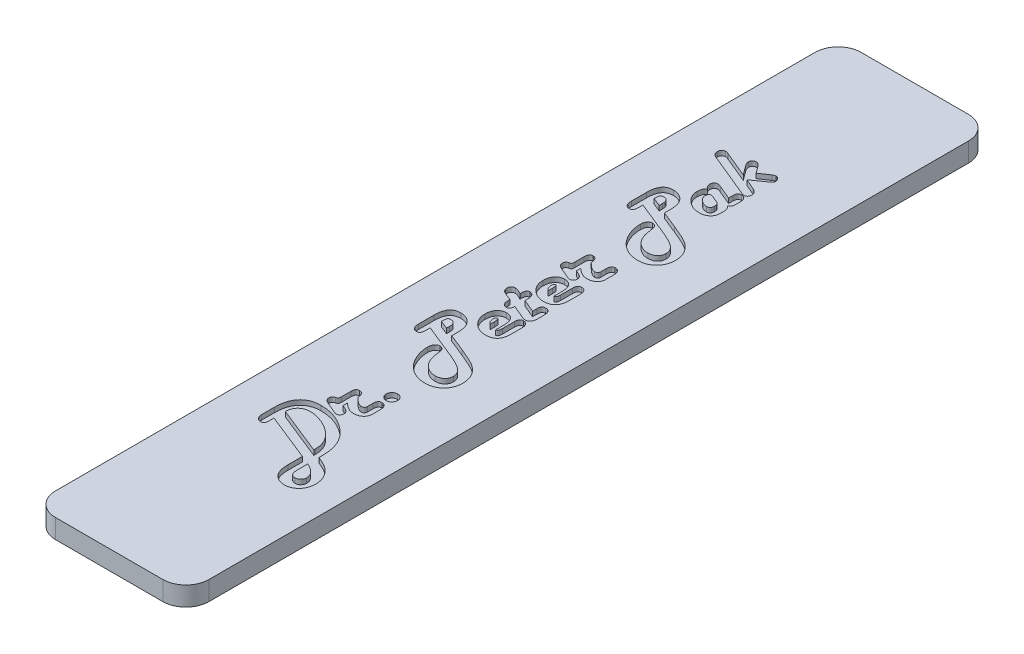
from build123d import *

# Parameters (mm, degrees)
BOSS_EXTRUDE1_DEPTH      = 66.675
BOSS_EXTRUDE1_DEPTH_BACK = 66.675
SKETCH3_W                = 25.4
SKETCH3_H                = 3.175
SKETCH5_OUTSIDE_W        = 54.556
SKETCH5_OUTSIDE_H        = 162.506
CUT_EXTRUDE2_DEPTH       = 68.947967225
CUT_EXTRUDE1_DEPTH       = 0.79375


with BuildPart() as part:
    # Sketch3 → Boss-Extrude1 (new, two sides: drawn at the far end of the back side and taken through both)
    with BuildSketch(Plane.XY.offset(-BOSS_EXTRUDE1_DEPTH_BACK)):
        Rectangle(SKETCH3_W, SKETCH3_H)
    extrude(amount=BOSS_EXTRUDE1_DEPTH + BOSS_EXTRUDE1_DEPTH_BACK)

    # Sketch5 outside → Cut-Extrude2 (cut, through all)
    with BuildSketch(Plane(origin=(0, 1.5875, 0), x_dir=(1, 0, 0), z_dir=(0, 1, 0))):
        Rectangle(SKETCH5_OUTSIDE_W, SKETCH5_OUTSIDE_H)
        with BuildLine():
            Line((12.7, -62.865), (12.7, 62.865))
            ThreePointArc((12.7, 62.865), (11.584076836, 65.559076836), (8.89, 66.675))
            Line((8.89, 66.675), (-8.89, 66.675))
            ThreePointArc((-8.89, 66.675), (-11.584076836, 65.559076836), (-12.7, 62.865))
            Line((-12.7, 62.865), (-12.7, -62.865))
            ThreePointArc((-12.7, -62.865), (-11.584076836, -65.559076836), (-8.89, -66.675))
            Line((-8.89, -66.675), (8.89, -66.675))
            ThreePointArc((8.89, -66.675), (11.584076836, -65.559076836), (12.7, -62.865))
        make_face(mode=Mode.SUBTRACT)
    extrude(amount=-CUT_EXTRUDE2_DEPTH, mode=Mode.SUBTRACT)

    # Sketch4 → Cut-Extrude1 (cut)
    # profile 1 of 11: a face of its own
    with BuildSketch(Plane(origin=(0, 1.5875, 0), x_dir=(1, 0, 0), z_dir=(0, 1, 0))):
        with BuildLine():
            Line((-5.059408711, -34.33587009), (-5.059408711, -34.996860326))
            Line((-5.059408711, -34.996860326), (-5.059408711, -35.176950481))
            add(Edge.make_bspline(
                [(-5.059408711, -35.176950481), (-5.061221798, -35.239070279), (-5.064618151, -35.355435815), (-5.091535017, -35.518362706), (-5.138308522, -35.657752882), (-5.205847499, -35.772968653), (-5.29318842, -35.864383142), (-5.402611201, -35.926519392), (-5.529823431, -35.965196763), (-5.621149297, -35.968700756), (-5.668944619, -35.970534568)],
                knots=[0, 0, 0, 0, 1.305737749, 2.445965353, 3.459324035, 4.379959175, 5.233349143, 6.085046436, 6.997810513, 8, 8, 8, 8], degree=3))
            add(Edge.make_bspline(
                [(-5.668944619, -35.970534568), (-5.731410963, -35.966821389), (-5.854689489, -35.95949336), (-6.031538734, -35.89798191), (-6.188487424, -35.792821135), (-6.326529965, -35.654362319), (-6.43823444, -35.48639006), (-6.52045023, -35.296879428), (-6.571281185, -35.089215715), (-6.576577835, -34.944379656), (-6.579290454, -34.870203515)],
                knots=[0, 0, 0, 0, 0.941902933, 1.858863449, 2.78744378, 3.773831386, 4.79357467, 5.815409039, 6.881186575, 8, 8, 8, 8], degree=3))
            Line((-6.579290454, -34.870203515), (-6.579290454, -34.69011336))
            Line((-6.579290454, -34.69011336), (-6.579290454, -32.732869815))
            add(Edge.make_bspline(
                [(-6.579290454, -32.732869815), (-6.576943694, -32.571806345), (-6.572385212, -32.258947337), (-6.528259255, -31.8045035), (-6.455923195, -31.37887443), (-6.353403231, -30.982189605), (-6.222361398, -30.613927792), (-6.065195062, -30.272698058), (-5.873740924, -29.962897523), (-5.655147073, -29.681791521), (-5.409385454, -29.431279407), (-5.136212127, -29.213989648), (-4.837107727, -29.030632634), (-4.511691276, -28.882277226), (-4.161606554, -28.764875306), (-3.786051006, -28.683032516), (-3.385240043, -28.63229192), (-3.109580017, -28.627109074), (-2.967592303, -28.62443948)],
                knots=[0, 0, 0, 0, 1.240121913, 2.408884614, 3.512215636, 4.562072732, 5.559962685, 6.519078054, 7.449661058, 8.358196616, 9.256317547, 10.145746268, 11.039719344, 11.951275398, 12.894325228, 13.877939151, 14.906963136, 16, 16, 16, 16], degree=3))
            add(Edge.make_bspline(
                [(-2.967592303, -28.62443948), (-2.747632965, -28.629485418), (-2.310664622, -28.639509613), (-1.662489052, -28.728652891), (-1.027874436, -28.868026538), (-0.407611195, -29.065683442), (0.198811118, -29.317568013), (0.789320154, -29.629065242), (1.369088674, -29.992468206), (1.733562556, -30.27564666), (1.918590017, -30.419403985)],
                knots=[0, 0, 0, 0, 0.99369571, 1.974062893, 2.951324249, 3.9272385, 4.912259598, 5.915104549, 6.941589699, 8, 8, 8, 8], degree=3))
            add(Edge.make_bspline(
                [(1.918590017, -30.419403985), (2.020560173, -30.503974547), (2.222042332, -30.671076962), (2.502478713, -30.939225735), (2.761785373, -31.214267866), (3.001726314, -31.496614155), (3.218070421, -31.788876693), (3.415328046, -32.088284432), (3.590018042, -32.396602873), (3.745118814, -32.714318831), (3.880396655, -33.044059274), (3.994887367, -33.388993793), (4.093794803, -33.748892028), (4.175487687, -34.125325579), (4.23491649, -34.517514808), (4.281986789, -34.924649152), (4.30655769, -35.348162206), (4.310957064, -35.636055011), (4.313195366, -35.782528363)],
                knots=[0, 0, 0, 0, 1.041972891, 2.058827374, 3.050103684, 4.014970579, 4.971989252, 5.909071109, 6.834104011, 7.757898592, 8.688895906, 9.635856426, 10.615406742, 11.624176682, 12.664286734, 13.734882699, 14.847559518, 16, 16, 16, 16], degree=3))
            Line((4.313195366, -35.782528363), (4.313195366, -36.253533382))
            Line((4.313195366, -36.253533382), (4.503180584, -36.334672902))
            add(Edge.make_bspline(
                [(4.503180584, -36.334672902), (4.588259484, -36.37297164), (4.751944871, -36.446655524), (4.988574197, -36.552434498), (5.203261613, -36.656245934), (5.399799285, -36.750640607), (5.57612167, -36.839432484), (5.731865259, -36.923041296), (5.86982203, -36.997189721), (6.025786476, -37.09306936), (6.206950257, -37.217106446), (6.417873247, -37.379286155), (6.623701124, -37.563731132), (6.754138311, -37.698701839), (6.820604438, -37.767478086)],
                knots=[0, 0, 0, 0, 1.222800361, 2.352575644, 3.396669397, 4.347862466, 5.210067408, 5.983579217, 6.664594993, 7.262130753, 8.381971782, 9.540587582, 10.746771362, 12, 12, 12, 12], degree=3))
            add(Edge.make_bspline(
                [(6.820604438, -37.767478086), (6.903395523, -37.861108257), (7.066380389, -38.045431253), (7.279287512, -38.341823861), (7.457034343, -38.649529571), (7.606030251, -38.965830535), (7.718433696, -39.294004825), (7.79973761, -39.632515205), (7.851106905, -39.981078901), (7.856747037, -40.217320255), (7.859586098, -40.336236551)],
                knots=[0, 0, 0, 0, 1.055914228, 2.078702545, 3.078046045, 4.055880218, 5.029205391, 6.004237832, 6.995397536, 8, 8, 8, 8], degree=3))
            add(Edge.make_bspline(
                [(7.859586098, -40.336236551), (7.856993501, -40.433277927), (7.851900251, -40.623919236), (7.821168372, -40.903022416), (7.764910307, -41.168424258), (7.687736712, -41.420900829), (7.588871721, -41.661063324), (7.467595534, -41.887846437), (7.324365245, -42.100676985), (7.160327756, -42.297987823), (6.979513426, -42.477098807), (6.785634375, -42.634307643), (6.578828947, -42.766211176), (6.361294215, -42.876232037), (6.129376676, -42.958420637), (5.887288606, -43.020940894), (5.632282094, -43.056641602), (5.458491616, -43.061063939), (5.36998814, -43.063316032)],
                knots=[0, 0, 0, 0, 1.126201464, 2.212463691, 3.25287726, 4.269850786, 5.272053028, 6.261782411, 7.249022054, 8.243830034, 9.23438794, 10.19795826, 11.134388982, 12.075812372, 13.02018767, 13.98375799, 14.973220915, 16, 16, 16, 16], degree=3))
            add(Edge.make_bspline(
                [(5.36998814, -43.063316032), (5.260123428, -43.060041196), (5.042463326, -43.053553208), (4.72333067, -42.985364351), (4.412900993, -42.885865132), (4.118355841, -42.740677877), (3.843725439, -42.562072673), (3.599045642, -42.350963317), (3.384255638, -42.110894138), (3.27040787, -41.929826533), (3.212864313, -41.838307179)],
                knots=[0, 0, 0, 0, 1.014242392, 2.009381349, 3.004557683, 4.021967388, 5.035219112, 6.025505851, 7.00200576, 8, 8, 8, 8], degree=3))
            add(Edge.make_bspline(
                [(3.212864313, -41.838307179), (3.178694237, -41.774893221), (3.108996627, -41.64554609), (3.024864607, -41.436299683), (2.954172904, -41.211734511), (2.894059757, -40.971360274), (2.850150029, -40.71452233), (2.815849805, -40.441895035), (2.796144893, -40.153142267), (2.794273346, -39.954976226), (2.793313624, -39.853357456)],
                knots=[0, 0, 0, 0, 0.84245226, 1.718372183, 2.633912599, 3.596293803, 4.615457363, 5.681185209, 6.810920853, 8, 8, 8, 8], degree=3))
            Line((2.793313624, -39.853357456), (2.793313624, -37.482500259))
            Line((2.793313624, -37.482500259), (-5.059408711, -34.33587009))
        make_face()
        with BuildLine():
            Line((2.793313624, -35.604417221), (2.793313624, -35.337250508))
            add(Edge.make_bspline(
                [(2.793313624, -35.337250508), (2.791702408, -35.251443318), (2.788512013, -35.081535058), (2.765744949, -34.829184342), (2.731199038, -34.581749589), (2.679029552, -34.340050259), (2.613727287, -34.104120162), (2.534611676, -33.873075379), (2.438580345, -33.647704415), (2.331215749, -33.425716598), (2.204488928, -33.211629246), (2.066703887, -33.001549356), (1.912916822, -32.797643994), (1.748048442, -32.596756539), (1.563156135, -32.405564208), (1.36913731, -32.214443891), (1.155852095, -32.032884011), (1.006709699, -31.916949657), (0.931062687, -31.858146208)],
                knots=[0, 0, 0, 0, 1.003752549, 1.98754731, 2.96218803, 3.924869515, 4.877913061, 5.824875223, 6.779479857, 7.742439712, 8.707376773, 9.687714611, 10.680189018, 11.694008127, 12.725763052, 13.790025714, 14.879071578, 16, 16, 16, 16], degree=3))
            add(Edge.make_bspline(
                [(0.931062687, -31.858146208), (0.78095443, -31.748874124), (0.481506127, -31.530889181), (0.004268718, -31.247507354), (-0.489791834, -30.996342005), (-0.997698155, -30.785520053), (-1.503867768, -30.613825412), (-1.997313923, -30.489723638), (-2.471672235, -30.411990293), (-2.782613813, -30.402334379), (-2.933949087, -30.397634846)],
                knots=[0, 0, 0, 0, 1.061151743, 2.116872814, 3.169496409, 4.227969904, 5.258553914, 6.222792805, 7.135033211, 8, 8, 8, 8], degree=3))
            add(Edge.make_bspline(
                [(-2.933949087, -30.397634846), (-3.013845359, -30.398923077), (-3.170118018, -30.401442786), (-3.398491181, -30.427923398), (-3.614094748, -30.470189606), (-3.815738777, -30.532775631), (-4.005154858, -30.609624668), (-4.182086066, -30.704588863), (-4.344678265, -30.818297277), (-4.494222588, -30.946788351), (-4.625964823, -31.092201747), (-4.744719615, -31.248282581), (-4.840786984, -31.419658248), (-4.920660454, -31.601992475), (-4.985190639, -31.796413708), (-5.026231366, -32.004608012), (-5.056449288, -32.224044889), (-5.058404564, -32.374554613), (-5.059408711, -32.451850013)],
                knots=[0, 0, 0, 0, 1.145531499, 2.240595844, 3.292755274, 4.292422607, 5.264114043, 6.220902991, 7.165828125, 8.104908158, 9.042461542, 9.975419986, 10.911970153, 11.852526766, 12.827988561, 13.843075609, 14.892295267, 16, 16, 16, 16], degree=3))
            Line((-5.059408711, -32.451850013), (2.793313624, -35.604417221))
        make_face(mode=Mode.SUBTRACT)
        with BuildLine():
            Line((4.313195366, -38.129637407), (4.313195366, -39.900853761))
            add(Edge.make_bspline(
                [(4.313195366, -39.900853761), (4.31614167, -39.999987045), (4.321654732, -40.185483134), (4.364073868, -40.445070503), (4.436805351, -40.666769991), (4.546252795, -40.847656017), (4.683522298, -40.992668884), (4.85579496, -41.093013579), (5.057259646, -41.153831425), (5.201313756, -41.160146841), (5.276974544, -41.163463854)],
                knots=[0, 0, 0, 0, 1.31364871, 2.458071474, 3.475829816, 4.38621616, 5.23967168, 6.094559773, 6.99921559, 8, 8, 8, 8], degree=3))
            add(Edge.make_bspline(
                [(5.276974544, -41.163463854), (5.340740764, -41.160311482), (5.46538183, -41.154149676), (5.642954311, -41.097622661), (5.806069188, -41.009534465), (5.945616014, -40.883548868), (6.065652646, -40.736718051), (6.151671976, -40.568120409), (6.2026179, -40.383354896), (6.209511273, -40.255419785), (6.213047544, -40.189789613)],
                knots=[0, 0, 0, 0, 1.015443884, 1.984844108, 2.946375274, 3.953924431, 4.965428653, 5.959234333, 6.953095811, 8, 8, 8, 8], degree=3))
            add(Edge.make_bspline(
                [(6.213047544, -40.189789613), (6.211514639, -40.139567592), (6.208451875, -40.039223366), (6.183926181, -39.889862013), (6.143090171, -39.742669224), (6.091088734, -39.59568051), (6.0182553, -39.452564706), (5.929850705, -39.312150276), (5.830080079, -39.170405721), (5.667591001, -38.987391259), (5.43470557, -38.765005086), (5.106825033, -38.52592429), (4.730688138, -38.308632012), (4.455753033, -38.190757156), (4.313195366, -38.129637407)],
                knots=[0, 0, 0, 0, 0.609246736, 1.21728261, 1.830931323, 2.461525313, 3.105941494, 3.774613737, 4.474427454, 5.206422339, 6.740961797, 8.372497183, 10.119089455, 12, 12, 12, 12], degree=3))
        make_face(mode=Mode.SUBTRACT)
    # profile 2 of 11: a face of its own
    with BuildSketch(Plane(origin=(0, 1.5875, 0), x_dir=(1, 0, 0), z_dir=(0, 1, 0))):
        with BuildLine():
            Line((-1.133047544, -26.833433), (-0.590798068, -27.068935509))
            add(Edge.make_bspline(
                [(-0.590798068, -27.068935509), (-0.533457734, -27.095488437), (-0.424228786, -27.146069733), (-0.277391243, -27.236424673), (-0.150092315, -27.328882076), (-0.046402559, -27.42989038), (0.034874377, -27.537677286), (0.090963623, -27.652688706), (0.126477166, -27.773354776), (0.131161299, -27.856342883), (0.133520575, -27.898141824)],
                knots=[0, 0, 0, 0, 1.297501196, 2.471640463, 3.537215363, 4.524637192, 5.43567625, 6.296618738, 7.14205136, 8, 8, 8, 8], degree=3))
            add(Edge.make_bspline(
                [(0.133520575, -27.898141824), (0.132124839, -27.947855354), (0.129409557, -28.04456869), (0.093846564, -28.182051687), (0.040725262, -28.308586742), (-0.036730962, -28.417178604), (-0.126767084, -28.509908615), (-0.231464824, -28.577074493), (-0.348059997, -28.61594425), (-0.428897175, -28.621572344), (-0.470078294, -28.62443948)],
                knots=[0, 0, 0, 0, 1.131994738, 2.202197021, 3.220602635, 4.248319073, 5.22801886, 6.155513921, 7.060358075, 8, 8, 8, 8], degree=3))
            add(Edge.make_bspline(
                [(-0.470078294, -28.62443948), (-0.499218044, -28.621858117), (-0.566980404, -28.615855347), (-0.679647346, -28.58571063), (-0.816933777, -28.536595778), (-0.916176579, -28.496235873), (-0.970768504, -28.474034516)],
                knots=[0, 0, 0, 0, 0.667539348, 1.552314029, 2.65356594, 4, 4, 4, 4], degree=3))
            Line((-0.970768504, -28.474034516), (-2.763753997, -27.704198581))
            add(Edge.make_bspline(
                [(-2.763753997, -27.704198581), (-2.815170125, -27.68098073), (-2.913349865, -27.636645954), (-3.045413745, -27.553762069), (-3.158743629, -27.465975937), (-3.251729515, -27.369577754), (-3.324450011, -27.266449224), (-3.374003716, -27.154595601), (-3.408159145, -27.036644475), (-3.41128251, -26.95439963), (-3.412870157, -26.912593507)],
                knots=[0, 0, 0, 0, 1.242093141, 2.371792344, 3.427691145, 4.394328043, 5.313892613, 6.192305435, 7.081125362, 8, 8, 8, 8], degree=3))
            add(Edge.make_bspline(
                [(-3.412870157, -26.912593507), (-3.411163979, -26.872277472), (-3.407925024, -26.795742815), (-3.388612461, -26.685974127), (-3.353327552, -26.588661404), (-3.302774108, -26.503574691), (-3.238231802, -26.430181439), (-3.157775444, -26.371641273), (-3.064804408, -26.322147821), (-2.995783937, -26.30181863), (-2.959676252, -26.291183524)],
                knots=[0, 0, 0, 0, 1.15314347, 2.189090296, 3.173792814, 4.095790583, 5.004376053, 5.947550008, 6.926271946, 8, 8, 8, 8], degree=3))
            Line((-2.959676252, -26.291183524), (-2.759795971, -26.235771169))
            add(Edge.make_bspline(
                [(-2.759795971, -26.235771169), (-2.735748973, -26.229359334), (-2.691703864, -26.217615249), (-2.634585283, -26.189438195), (-2.59151934, -26.156434449), (-2.560947532, -26.111906012), (-2.544747313, -26.049315304), (-2.534309592, -25.962368834), (-2.526479032, -25.846680551), (-2.526345982, -25.75949929), (-2.526272474, -25.711332807)],
                knots=[0, 0, 0, 0, 0.926850573, 1.697643703, 2.362895762, 2.92973869, 3.677374781, 4.746381598, 6.202419277, 8, 8, 8, 8], degree=3))
            Line((-2.526272474, -25.711332807), (-2.526272474, -24.147912786))
            add(Edge.make_bspline(
                [(-2.526272474, -24.147912786), (-2.524532467, -24.081828826), (-2.521278246, -23.958236375), (-2.493558114, -23.785231937), (-2.449642601, -23.637679104), (-2.386772452, -23.514497809), (-2.300876341, -23.420171661), (-2.196591421, -23.352913681), (-2.07396949, -23.31214768), (-1.986325506, -23.307358359), (-1.940484719, -23.304853382)],
                knots=[0, 0, 0, 0, 1.361355543, 2.546053047, 3.599677592, 4.524244374, 5.371169927, 6.197098625, 7.057021238, 8, 8, 8, 8], degree=3))
            add(Edge.make_bspline(
                [(-1.940484719, -23.304853382), (-1.876704344, -23.30709926), (-1.755337885, -23.3113729), (-1.587019418, -23.365145387), (-1.441985775, -23.449273392), (-1.327816684, -23.573511056), (-1.236574655, -23.728204747), (-1.175701967, -23.917251418), (-1.138009761, -24.138487685), (-1.134775851, -24.296818928), (-1.133047544, -24.381436283)],
                knots=[0, 0, 0, 0, 0.994284648, 1.892005291, 2.734571892, 3.588753721, 4.500369607, 5.525254763, 6.677415825, 8, 8, 8, 8], degree=3))
            Line((-1.133047544, -24.381436283), (-1.067740125, -24.450701727))
            add(Edge.make_bspline(
                [(-1.067740125, -24.450701727), (-0.987921256, -24.529888015), (-0.835136029, -24.681462388), (-0.60704457, -24.886736669), (-0.391993659, -25.059998761), (-0.193594409, -25.204373663), (-0.006185567, -25.314322596), (0.165468107, -25.394579133), (0.324390219, -25.447426319), (0.42739902, -25.454628705), (0.475889769, -25.458019183)],
                knots=[0, 0, 0, 0, 1.435762249, 2.748263184, 3.91660617, 4.961556361, 5.879059361, 6.685751502, 7.381325737, 8, 8, 8, 8], degree=3))
            add(Edge.make_bspline(
                [(0.475889769, -25.458019183), (0.518360985, -25.457179821), (0.59906364, -25.455584886), (0.710559399, -25.42543351), (0.809251217, -25.386772504), (0.88615109, -25.321677996), (0.948196196, -25.241984025), (0.990380475, -25.143937204), (1.017109736, -25.029325476), (1.019069792, -24.947607755), (1.020118258, -24.903895632)],
                knots=[0, 0, 0, 0, 1.140484469, 2.167117703, 3.098941929, 3.971150526, 4.846255631, 5.80154673, 6.824011975, 8, 8, 8, 8], degree=3))
            Line((1.020118258, -24.903895632), (1.020118258, -24.060836228))
            add(Edge.make_bspline(
                [(1.020118258, -24.060836228), (1.021984217, -23.991494855), (1.025466972, -23.862071303), (1.051533923, -23.680365868), (1.100887158, -23.526711724), (1.167116652, -23.39865201), (1.255478016, -23.299063797), (1.363636668, -23.227660786), (1.492717348, -23.184969511), (1.585120442, -23.180527612), (1.63361219, -23.17819657)],
                knots=[0, 0, 0, 0, 1.364190584, 2.546219988, 3.596843527, 4.525897283, 5.362221888, 6.186477391, 7.048290713, 8, 8, 8, 8], degree=3))
            add(Edge.make_bspline(
                [(1.63361219, -23.17819657), (1.70200856, -23.181779128), (1.833530254, -23.188668151), (2.018290659, -23.247552684), (2.178749377, -23.345312464), (2.309797916, -23.483899654), (2.41659376, -23.654243171), (2.487295379, -23.858606044), (2.534438198, -24.090343241), (2.538083095, -24.255170772), (2.54, -24.341856029)],
                knots=[0, 0, 0, 0, 0.982615473, 1.889504555, 2.759142238, 3.658944971, 4.610088785, 5.631441668, 6.75433984, 8, 8, 8, 8], degree=3))
            Line((2.54, -24.341856029), (2.54, -25.651962427))
            add(Edge.make_bspline(
                [(2.54, -25.651962427), (2.538430408, -25.704162537), (2.535356682, -25.806385811), (2.512617758, -25.956119997), (2.478022786, -26.099256332), (2.425832595, -26.234424778), (2.359635976, -26.362129337), (2.280705326, -26.483907154), (2.184687895, -26.596539449), (2.076052454, -26.701402382), (1.955607585, -26.795530429), (1.827028716, -26.879465657), (1.68869591, -26.948931944), (1.5424848, -27.006582792), (1.386467302, -27.049929098), (1.222288609, -27.081010515), (1.049676112, -27.101872547), (0.931785098, -27.103651135), (0.871692306, -27.104557738)],
                knots=[0, 0, 0, 0, 1.009407673, 1.976719137, 2.923785669, 3.852797958, 4.771676065, 5.702527031, 6.65345443, 7.628144937, 8.618662201, 9.606215811, 10.593522047, 11.607757909, 12.641947342, 13.720607507, 14.838121302, 16, 16, 16, 16], degree=3))
            add(Edge.make_bspline(
                [(0.871692306, -27.104557738), (0.793683688, -27.101750988), (0.637343317, -27.096125863), (0.405084974, -27.054818229), (0.175746401, -26.989818687), (-0.053629714, -26.893414686), (-0.292447526, -26.761850872), (-0.551427767, -26.591954353), (-0.835914279, -26.381388246), (-1.030170108, -26.222791837), (-1.133047544, -26.138799547)],
                knots=[0, 0, 0, 0, 0.822710096, 1.64882809, 2.481516469, 3.333299355, 4.267584386, 5.354441073, 6.598918144, 8, 8, 8, 8], degree=3))
            Line((-1.133047544, -26.138799547), (-1.133047544, -26.833433))
        make_face()
    # profile 3 of 11: a face of its own
    with BuildSketch(Plane(origin=(0, 1.5875, 0), x_dir=(1, 0, 0), z_dir=(0, 1, 0))):
        with BuildLine():
            add(Edge.make_bspline(
                [(0.766804634, -21.591028396), (0.770139014, -21.527972394), (0.776646221, -21.404915467), (0.830830714, -21.227562546), (0.91939683, -21.064438727), (1.042292932, -20.920548631), (1.186183028, -20.797652529), (1.349306847, -20.709086412), (1.526659768, -20.65490192), (1.649716695, -20.648394712), (1.712772698, -20.645060333)],
                knots=[0, 0, 0, 0, 1.018015329, 1.986707578, 2.970091954, 4, 5.029908046, 6.013292422, 6.981984671, 8, 8, 8, 8], degree=3))
            add(Edge.make_bspline(
                [(1.712772698, -20.645060333), (1.776467102, -20.648469211), (1.901411116, -20.655156123), (2.081524984, -20.708676797), (2.246960005, -20.797076041), (2.391134327, -20.920602422), (2.514073317, -21.064425036), (2.602628499, -21.22756606), (2.656815813, -21.404914542), (2.663322631, -21.527972081), (2.666656812, -21.591028396)],
                knots=[0, 0, 0, 0, 1.023458974, 2.007634331, 2.995409192, 4.02013336, 5.044857529, 6.023292197, 6.987108688, 8, 8, 8, 8], degree=3))
            add(Edge.make_bspline(
                [(2.666656812, -21.591028396), (2.663248136, -21.654723119), (2.656561621, -21.779667758), (2.603038054, -21.959777074), (2.514649886, -22.125229527), (2.391080568, -22.269336267), (2.246973829, -22.392905585), (2.081521375, -22.481293753), (1.901412059, -22.534817319), (1.77646742, -22.541503835), (1.712772698, -22.544912511)],
                knots=[0, 0, 0, 0, 1.018333356, 1.997579833, 2.980407786, 4, 5.019592214, 6.002420167, 6.981666644, 8, 8, 8, 8], degree=3))
            add(Edge.make_bspline(
                [(1.712772698, -22.544912511), (1.649716382, -22.54157833), (1.526658843, -22.535071511), (1.349310361, -22.480884198), (1.186169337, -22.392329016), (1.042346723, -22.269390026), (0.918820342, -22.125215704), (0.830421099, -21.959780683), (0.776900424, -21.779666815), (0.770213512, -21.654722801), (0.766804634, -21.591028396)],
                knots=[0, 0, 0, 0, 1.012891312, 1.976707803, 2.955142471, 3.97986664, 5.004590808, 5.992365669, 6.976541026, 8, 8, 8, 8], degree=3))
        make_face()
    # profile 4 of 11: a face of its own
    with BuildSketch(Plane(origin=(0, 1.5875, 0), x_dir=(1, 0, 0), z_dir=(0, 1, 0))):
        with BuildLine():
            Line((-2.146302039, -7.828974183), (0.624315721, -8.941179312))
            add(Edge.make_bspline(
                [(0.624315721, -8.941179312), (0.789377123, -9.008116775), (1.106234776, -9.136612275), (1.559915681, -9.327072264), (1.973708728, -9.504834033), (2.347752684, -9.671109402), (2.683015178, -9.824551847), (2.976686795, -9.968988041), (3.231257431, -10.099282812), (3.51587663, -10.256110895), (3.832787043, -10.460500497), (4.180178167, -10.732304273), (4.500038527, -11.033739238), (4.688000123, -11.257340968), (4.782221372, -11.369427877)],
                knots=[0, 0, 0, 0, 1.316025526, 2.52628873, 3.635396764, 4.643473973, 5.550686247, 6.359394249, 7.061322966, 7.663498093, 8.7599393, 9.843181906, 10.918831827, 12, 12, 12, 12], degree=3))
            add(Edge.make_bspline(
                [(4.782221372, -11.369427877), (4.845627918, -11.454218436), (4.971126534, -11.622041769), (5.133970193, -11.88955549), (5.273128552, -12.165673447), (5.384346469, -12.45370045), (5.471355875, -12.751015286), (5.534883174, -13.058639886), (5.573553013, -13.376471832), (5.577676538, -13.591750627), (5.579763485, -13.70070482)],
                knots=[0, 0, 0, 0, 1.011044617, 2.001129376, 2.987597007, 3.961339675, 4.946518016, 5.943976879, 6.959431467, 8, 8, 8, 8], degree=3))
            add(Edge.make_bspline(
                [(5.579763485, -13.70070482), (5.57731332, -13.814977832), (5.572523406, -14.038374216), (5.528900147, -14.364617086), (5.463620918, -14.675549861), (5.364926237, -14.9691575), (5.243100823, -15.247954556), (5.09093589, -15.508914001), (4.912475782, -15.753556817), (4.706461454, -15.978096821), (4.480218246, -16.181623998), (4.23488457, -16.358445884), (3.974444442, -16.510584581), (3.696034453, -16.633038605), (3.401625809, -16.728596682), (3.09116848, -16.794677069), (2.764849632, -16.838066541), (2.541463861, -16.842889109), (2.427196277, -16.845355977)],
                knots=[0, 0, 0, 0, 1.095039877, 2.140732475, 3.150521304, 4.13652018, 5.104897175, 6.062745876, 7.026672252, 8.00261995, 8.979018386, 9.939223627, 10.897072327, 11.865449322, 12.849478696, 13.859267525, 14.904960123, 16, 16, 16, 16], degree=3))
            add(Edge.make_bspline(
                [(2.427196277, -16.845355977), (2.273271358, -16.841134175), (1.969377772, -16.832799082), (1.52113617, -16.767608782), (1.087796145, -16.661449818), (0.669674658, -16.508476253), (0.264598292, -16.317578777), (-0.123230491, -16.078734247), (-0.497388389, -15.799577211), (-0.728581178, -15.584962501), (-0.846090705, -15.475879199)],
                knots=[0, 0, 0, 0, 1.013796752, 2.00153641, 2.977647105, 3.948285219, 4.930040032, 5.922901228, 6.94426252, 8, 8, 8, 8], degree=3))
            add(Edge.make_bspline(
                [(-0.846090705, -15.475879199), (-0.908233874, -15.413290905), (-1.033666244, -15.286960078), (-1.208089414, -15.082927265), (-1.375458314, -14.868963784), (-1.53159151, -14.642277718), (-1.679721911, -14.405355868), (-1.819553342, -14.156926763), (-1.946587619, -13.895556768), (-2.107410418, -13.537367834), (-2.273511197, -13.079990255), (-2.419472708, -12.526517293), (-2.507911782, -11.97389063), (-2.520173583, -11.605897267), (-2.526272474, -11.422861219)],
                knots=[0, 0, 0, 0, 0.706169296, 1.425361597, 2.148231665, 2.881015689, 3.628657503, 4.385575625, 5.162942875, 5.955265483, 7.529696308, 9.053365446, 10.534374814, 12, 12, 12, 12], degree=3))
            add(Edge.make_bspline(
                [(-2.526272474, -11.422861219), (-2.52435614, -11.339455954), (-2.520688649, -11.179834556), (-2.472662338, -10.954505145), (-2.403779561, -10.75186195), (-2.299692161, -10.5794643), (-2.173947777, -10.436284796), (-2.024224345, -10.332203817), (-1.854112317, -10.269712235), (-1.734527864, -10.262760195), (-1.673318007, -10.25920176)],
                knots=[0, 0, 0, 0, 1.238099196, 2.369480208, 3.412225081, 4.406632522, 5.344448297, 6.226188743, 7.092066479, 8, 8, 8, 8], degree=3))
            add(Edge.make_bspline(
                [(-1.673318007, -10.25920176), (-1.608766585, -10.263262399), (-1.482919216, -10.271178888), (-1.304118815, -10.337587947), (-1.147235277, -10.44991367), (-1.066136078, -10.551185174), (-1.024201846, -10.603549968)],
                knots=[0, 0, 0, 0, 1.010937669, 1.970891475, 2.950802117, 4, 4, 4, 4], degree=3))
            add(Edge.make_bspline(
                [(-1.024201846, -10.603549968), (-1.000208251, -10.64372721), (-0.946169923, -10.734214319), (-0.8950237, -10.90592612), (-0.852084744, -11.119784721), (-0.835395033, -11.278813087), (-0.826300578, -11.365469852)],
                knots=[0, 0, 0, 0, 0.704559972, 1.586808607, 2.68501851, 4, 4, 4, 4], degree=3))
            add(Edge.make_bspline(
                [(-0.826300578, -11.365469852), (-0.815523738, -11.472478101), (-0.794507324, -11.681159829), (-0.745268421, -11.985192301), (-0.689976017, -12.274513311), (-0.617775867, -12.547530636), (-0.536352927, -12.805662982), (-0.447205222, -13.049570406), (-0.341250788, -13.276205373), (-0.261788872, -13.418805659), (-0.222701709, -13.488950463)],
                knots=[0, 0, 0, 0, 1.159710426, 2.261604866, 3.320677166, 4.335395728, 5.305245955, 6.239579045, 7.134052342, 8, 8, 8, 8], degree=3))
            add(Edge.make_bspline(
                [(-0.222701709, -13.488950463), (-0.152857084, -13.597806628), (-0.015266807, -13.81224761), (0.236945987, -14.097292815), (0.51709467, -14.348861696), (0.826540541, -14.561487624), (1.155939902, -14.731320184), (1.497291846, -14.855921586), (1.848578131, -14.932285025), (2.086435705, -14.941093039), (2.205546856, -14.945503799)],
                knots=[0, 0, 0, 0, 1.047576128, 2.063670475, 3.075290511, 4.094745252, 5.099666308, 6.072755065, 7.034899922, 8, 8, 8, 8], degree=3))
            add(Edge.make_bspline(
                [(2.205546856, -14.945503799), (2.264967465, -14.94442354), (2.381446153, -14.942305971), (2.551433222, -14.924004719), (2.712747882, -14.895502057), (2.863193073, -14.850930509), (3.005140482, -14.797526966), (3.138752442, -14.732871812), (3.260797004, -14.652580961), (3.37509624, -14.564238026), (3.474989116, -14.46241462), (3.56538003, -14.35456867), (3.63830379, -14.235653065), (3.700997148, -14.110417562), (3.747816582, -13.975871306), (3.781184235, -13.833230028), (3.804421175, -13.682992261), (3.80584261, -13.579417087), (3.806568119, -13.526551704)],
                knots=[0, 0, 0, 0, 1.180906515, 2.314860832, 3.395146952, 4.432720844, 5.428859457, 6.408284318, 7.375873327, 8.328235049, 9.274073667, 10.205991361, 11.119268818, 12.040047653, 12.985704432, 13.943108951, 14.9501506, 16, 16, 16, 16], degree=3))
            add(Edge.make_bspline(
                [(3.806568119, -13.526551704), (3.805095948, -13.459099757), (3.802189936, -13.325952078), (3.766169898, -13.131080401), (3.713226389, -12.942922507), (3.637019696, -12.761783086), (3.539785801, -12.587036735), (3.420064308, -12.419938575), (3.277859513, -12.261131151), (3.113273052, -12.1064506), (2.919188065, -11.955983731), (2.697681308, -11.798087863), (2.43929783, -11.64220298), (2.149517135, -11.478649825), (1.825046746, -11.314347647), (1.468320136, -11.142719878), (1.076168511, -10.972538246), (0.803223627, -10.858507326), (0.661916962, -10.799472224)],
                knots=[0, 0, 0, 0, 0.731676688, 1.444303058, 2.145016375, 2.851566032, 3.573211535, 4.312808279, 5.079163071, 5.88508809, 6.762346765, 7.744328667, 8.837972341, 10.037711651, 11.357883797, 12.787164715, 14.33667869, 16, 16, 16, 16], degree=3))
            Line((0.661916962, -10.799472224), (-5.059408711, -8.476111331))
            Line((-5.059408711, -8.476111331), (-5.059408711, -9.204387999))
            add(Edge.make_bspline(
                [(-5.059408711, -9.204387999), (-5.061216496, -9.27704883), (-5.064600783, -9.413074523), (-5.091466288, -9.603408404), (-5.137339102, -9.765841004), (-5.204622605, -9.899637131), (-5.291856035, -10.00531398), (-5.400196816, -10.081122671), (-5.529078586, -10.125985262), (-5.621085731, -10.130300377), (-5.668944619, -10.132544949)],
                knots=[0, 0, 0, 0, 1.386647813, 2.595892835, 3.659749566, 4.594681301, 5.434731623, 6.248703716, 7.089037154, 8, 8, 8, 8], degree=3))
            add(Edge.make_bspline(
                [(-5.668944619, -10.132544949), (-5.73742889, -10.129310071), (-5.869533997, -10.123070042), (-6.055030485, -10.058684933), (-6.216588679, -9.954947082), (-6.350964412, -9.809135006), (-6.452989563, -9.624486871), (-6.528293171, -9.408520094), (-6.570403761, -9.159151537), (-6.576217316, -8.982896311), (-6.579290454, -8.889724982)],
                knots=[0, 0, 0, 0, 0.942409434, 1.817893302, 2.674221847, 3.569887169, 4.524363572, 5.567001171, 6.713877944, 8, 8, 8, 8], degree=3))
            Line((-6.579290454, -8.889724982), (-6.579290454, -6.346693682))
            add(Edge.make_bspline(
                [(-6.579290454, -6.346693682), (-6.577756358, -6.241758346), (-6.574781195, -6.038250957), (-6.552376986, -5.74370564), (-6.519213577, -5.46939901), (-6.464030506, -5.21815305), (-6.400871522, -4.986779587), (-6.31857222, -4.777922815), (-6.224757328, -4.588305563), (-6.112727652, -4.420318898), (-5.986034342, -4.273060913), (-5.842915791, -4.145900726), (-5.683340413, -4.039185635), (-5.509186716, -3.949436792), (-5.318033771, -3.881694165), (-5.111291989, -3.8356539), (-4.888814562, -3.804756838), (-4.734961223, -3.80142239), (-4.655690124, -3.799704356)],
                knots=[0, 0, 0, 0, 1.377779469, 2.672010327, 3.877566876, 5.002296731, 6.047021908, 7.023471041, 7.945492411, 8.820022801, 9.667536142, 10.489793169, 11.325896471, 12.182086672, 13.056145004, 13.980726477, 14.959593374, 16, 16, 16, 16], degree=3))
            add(Edge.make_bspline(
                [(-4.655690124, -3.799704356), (-4.557912888, -3.802996578), (-4.365993375, -3.809458631), (-4.084683535, -3.852943887), (-3.817914581, -3.928969221), (-3.564028538, -4.0338922), (-3.326024857, -4.172276889), (-3.100061644, -4.338262845), (-2.887100772, -4.533885581), (-2.762063453, -4.68474818), (-2.698446578, -4.761504521)],
                knots=[0, 0, 0, 0, 1.037190231, 2.03582197, 3.010506387, 3.973515094, 4.942177049, 5.923321209, 6.943420921, 8, 8, 8, 8], degree=3))
            add(Edge.make_bspline(
                [(-2.698446578, -4.761504521), (-2.654093198, -4.822564973), (-2.56303112, -4.947928397), (-2.45130456, -5.159862385), (-2.356121334, -5.394600309), (-2.280061128, -5.653459963), (-2.218749318, -5.934461113), (-2.175853562, -6.239384703), (-2.15003315, -6.56788916), (-2.147573198, -6.795220019), (-2.146302039, -6.91269131)],
                knots=[0, 0, 0, 0, 0.800437442, 1.643380872, 2.535600309, 3.486195869, 4.50417187, 5.586788071, 6.752993229, 8, 8, 8, 8], degree=3))
            Line((-2.146302039, -6.91269131), (-2.146302039, -7.828974183))
        make_face()
        with BuildLine():
            Line((-3.666183781, -7.179858022), (-3.666183781, -6.639587559))
            add(Edge.make_bspline(
                [(-3.666183781, -6.639587559), (-3.66854018, -6.556287208), (-3.67298768, -6.399064945), (-3.713426923, -6.179613743), (-3.782586096, -5.992380525), (-3.880359248, -5.837610129), (-4.009115314, -5.715731083), (-4.16839241, -5.633227471), (-4.352755836, -5.5793084), (-4.485073477, -5.57511057), (-4.554760477, -5.572899722)],
                knots=[0, 0, 0, 0, 1.258971058, 2.376199826, 3.358208907, 4.260347007, 5.121448143, 6.005251248, 6.949436718, 8, 8, 8, 8], degree=3))
            add(Edge.make_bspline(
                [(-4.554760477, -5.572899722), (-4.594477208, -5.574798547), (-4.669717665, -5.578395733), (-4.77533876, -5.605119629), (-4.86329517, -5.654976151), (-4.93797113, -5.721819581), (-4.992171605, -5.811188891), (-5.032495741, -5.917013499), (-5.055603233, -6.041611548), (-5.058085408, -6.130884293), (-5.059408711, -6.178477603)],
                knots=[0, 0, 0, 0, 1.057975811, 2.004258143, 2.869579862, 3.727735231, 4.644179764, 5.623179532, 6.73286349, 8, 8, 8, 8], degree=3))
            Line((-5.059408711, -6.178477603), (-5.059408711, -6.62573447))
            Line((-5.059408711, -6.62573447), (-3.666183781, -7.179858022))
        make_face(mode=Mode.SUBTRACT)
    # profile 5 of 11: a face of its own
    with BuildSketch(Plane(origin=(0, 1.5875, 0), x_dir=(1, 0, 0), z_dir=(0, 1, 0))):
        with BuildLine():
            add(Edge.make_bspline(
                [(0.640147822, -3.342552425), (0.670244436, -3.340486692), (0.728816908, -3.33646647), (0.809921083, -3.298062436), (0.877265541, -3.235636667), (0.930166473, -3.149746811), (0.971878365, -3.041845311), (0.999671069, -2.910984148), (1.017475561, -2.756593364), (1.019194529, -2.645999717), (1.020118258, -2.58656958)],
                knots=[0, 0, 0, 0, 0.764367135, 1.48757176, 2.238468815, 3.079136104, 4.038989023, 5.178564659, 6.483834326, 8, 8, 8, 8], degree=3))
            Line((1.020118258, -2.58656958), (1.020118258, -0.603598869))
            add(Edge.make_bspline(
                [(1.020118258, -0.603598869), (1.021673009, -0.536817069), (1.024600252, -0.411082103), (1.054949664, -0.235673911), (1.099727212, -0.084103807), (1.170033463, 0.039378262), (1.25958074, 0.136714523), (1.36944866, 0.205538457), (1.499587842, 0.246294788), (1.592401202, 0.250884332), (1.641528241, 0.253313624)],
                knots=[0, 0, 0, 0, 1.330378268, 2.504800222, 3.540784378, 4.466013521, 5.313015675, 6.152526175, 7.022113639, 8, 8, 8, 8], degree=3))
            add(Edge.make_bspline(
                [(1.641528241, 0.253313624), (1.708633982, 0.250544389), (1.838316605, 0.245192812), (2.019863088, 0.185547273), (2.178880514, 0.089807972), (2.309870043, -0.046272114), (2.415541993, -0.213806114), (2.488156418, -0.4141937), (2.534143448, -0.642397604), (2.537985911, -0.805213254), (2.54, -0.890555708)],
                knots=[0, 0, 0, 0, 0.976459769, 1.88701984, 2.755728993, 3.661387505, 4.617841531, 5.626579212, 6.755933135, 8, 8, 8, 8], degree=3))
            Line((2.54, -0.890555708), (2.54, -2.780512823))
            add(Edge.make_bspline(
                [(2.54, -2.780512823), (2.538612156, -2.866333066), (2.535926828, -3.032386039), (2.51149646, -3.273776561), (2.473095175, -3.499018748), (2.417021118, -3.708829106), (2.346825719, -3.903884766), (2.257413798, -4.081909459), (2.153248842, -4.24438254), (2.035111915, -4.391827574), (1.898764711, -4.520488938), (1.750700517, -4.634713312), (1.585472037, -4.728009562), (1.406292209, -4.805346931), (1.212663216, -4.866326575), (1.004582376, -4.909870098), (0.781985184, -4.935865927), (0.628346233, -4.938339842), (0.549113239, -4.939615662)],
                knots=[0, 0, 0, 0, 1.227434829, 2.374954843, 3.467242871, 4.492791281, 5.478078509, 6.427692534, 7.336082474, 8.235159391, 9.122921699, 10.011937165, 10.903903105, 11.829580614, 12.799608803, 13.802811811, 14.866890212, 16, 16, 16, 16], degree=3))
            add(Edge.make_bspline(
                [(0.549113239, -4.939615662), (0.446061743, -4.937044587), (0.243056497, -4.931979722), (-0.055916417, -4.889078639), (-0.343321931, -4.819697391), (-0.621692924, -4.724429963), (-0.887774736, -4.599409065), (-1.144273075, -4.447852946), (-1.387158589, -4.266091434), (-1.618955421, -4.062413522), (-1.831479511, -3.839426045), (-2.015357812, -3.600888304), (-2.173889046, -3.353983214), (-2.303695448, -3.095669449), (-2.402053948, -2.825613782), (-2.473844143, -2.546003578), (-2.519042952, -2.256229252), (-2.523843814, -2.05899792), (-2.526272474, -1.959222558)],
                knots=[0, 0, 0, 0, 1.040413245, 2.049551489, 3.043375534, 4.023141954, 5.015714557, 6.007526584, 7.026927923, 8.074887039, 9.121150428, 10.132661257, 11.112246432, 12.080619832, 13.046032014, 14.009142413, 14.992865218, 16, 16, 16, 16], degree=3))
            add(Edge.make_bspline(
                [(-2.526272474, -1.959222558), (-2.524414221, -1.887290433), (-2.520775976, -1.746455658), (-2.502277812, -1.540382537), (-2.465440757, -1.346287549), (-2.419145194, -1.162205653), (-2.355096336, -0.989567074), (-2.277851185, -0.827584497), (-2.189188035, -0.675014745), (-2.083161933, -0.537105893), (-1.968103854, -0.410925971), (-1.841920197, -0.300814464), (-1.707453133, -0.207258586), (-1.563450355, -0.132067357), (-1.41199211, -0.071236559), (-1.250157822, -0.030790802), (-1.079865324, -0.003768471), (-0.962961331, -0.001270789), (-0.903482072, 0)],
                knots=[0, 0, 0, 0, 1.20765167, 2.364442186, 3.467641136, 4.520347312, 5.546697016, 6.552049339, 7.529957554, 8.502082256, 9.465848252, 10.391794486, 11.307021153, 12.208414204, 13.113065312, 14.039540961, 15.002543477, 16, 16, 16, 16], degree=3))
            add(Edge.make_bspline(
                [(-0.903482072, 0), (-0.832755133, -0.00221098), (-0.694321685, -0.006538519), (-0.493792244, -0.042314847), (-0.307955785, -0.102666255), (-0.135009986, -0.182973173), (0.020800902, -0.292930421), (0.16343648, -0.423611927), (0.292866539, -0.57824576), (0.362705976, -0.695525186), (0.398708275, -0.755982846)],
                knots=[0, 0, 0, 0, 1.069075517, 2.092495602, 3.067309766, 4.01772645, 4.964103366, 5.938458037, 6.93727308, 8, 8, 8, 8], degree=3))
            add(Edge.make_bspline(
                [(0.398708275, -0.755982846), (0.418809052, -0.792475999), (0.460398127, -0.867981361), (0.505626446, -0.994165636), (0.547667146, -1.131400787), (0.583579949, -1.281209442), (0.608626877, -1.444753781), (0.625472087, -1.620548048), (0.638251339, -1.809294882), (0.639501231, -1.939408707), (0.640147822, -2.006718863)],
                knots=[0, 0, 0, 0, 0.775695059, 1.604934926, 2.492087677, 3.452766344, 4.473981776, 5.574285297, 6.74513539, 8, 8, 8, 8], degree=3))
            Line((0.640147822, -2.006718863), (0.640147822, -3.342552425))
        make_face()
        with BuildLine():
            Line((-0.626420296, -3.02195237), (-0.626420296, -2.285759651))
            add(Edge.make_bspline(
                [(-0.626420296, -2.285759651), (-0.627356762, -2.224413398), (-0.629100173, -2.110205429), (-0.637096571, -1.950624575), (-0.657114556, -1.817200339), (-0.681114983, -1.707522504), (-0.714936358, -1.623660939), (-0.75210131, -1.559338043), (-0.806292419, -1.523019631), (-0.845009803, -1.520910759), (-0.863901819, -1.519881742)],
                knots=[0, 0, 0, 0, 1.703756022, 3.171872855, 4.430737384, 5.448043455, 6.277929624, 6.938312386, 7.48195314, 8, 8, 8, 8], degree=3))
            add(Edge.make_bspline(
                [(-0.863901819, -1.519881742), (-0.8853278, -1.522643725), (-0.926474645, -1.527947888), (-0.983320352, -1.555939961), (-1.03064867, -1.597878874), (-1.069009204, -1.653815363), (-1.099020279, -1.722151508), (-1.116796064, -1.804871182), (-1.131986351, -1.899967342), (-1.13267925, -1.968377883), (-1.133047544, -2.00473985)],
                knots=[0, 0, 0, 0, 0.839283018, 1.611774451, 2.433858042, 3.284934843, 4.2429058, 5.330802008, 6.5812524, 8, 8, 8, 8], degree=3))
            add(Edge.make_bspline(
                [(-1.133047544, -2.00473985), (-1.131605482, -2.056952435), (-1.128778735, -2.159300178), (-1.104251411, -2.308659965), (-1.065387383, -2.449839299), (-1.008345489, -2.582204123), (-0.938522912, -2.707157264), (-0.848366271, -2.820940818), (-0.746575498, -2.929042643), (-0.666907473, -2.990645756), (-0.626420296, -3.02195237)],
                knots=[0, 0, 0, 0, 1.059074119, 2.076009944, 3.063613489, 4.023510937, 4.995010178, 5.959100355, 6.962817714, 8, 8, 8, 8], degree=3))
        make_face(mode=Mode.SUBTRACT)
    # profile 6 of 11: a face of its own
    with BuildSketch(Plane(origin=(0, 1.5875, 0), x_dir=(1, 0, 0), z_dir=(0, 1, 0))):
        with BuildLine():
            Line((-2.526272474, 3.841263622), (-2.526272474, 4.047080941))
            add(Edge.make_bspline(
                [(-2.526272474, 4.047080941), (-2.525482466, 4.117160788), (-2.524006752, 4.248068051), (-2.494660522, 4.430235142), (-2.454842929, 4.58688571), (-2.389532171, 4.714317362), (-2.310854006, 4.81763592), (-2.208854123, 4.889963605), (-2.088809757, 4.932472566), (-2.002845089, 4.937177458), (-1.958295834, 4.939615662)],
                knots=[0, 0, 0, 0, 1.404766941, 2.624066756, 3.697329339, 4.633101669, 5.481073342, 6.278523074, 7.107883314, 8, 8, 8, 8], degree=3))
            add(Edge.make_bspline(
                [(-1.958295834, 4.939615662), (-1.896464495, 4.935997599), (-1.77713765, 4.929015184), (-1.607864703, 4.869199256), (-1.462481032, 4.767364929), (-1.342724862, 4.626652238), (-1.248198018, 4.453977131), (-1.178632904, 4.251449643), (-1.140623454, 4.018807755), (-1.135662378, 3.854592888), (-1.133047544, 3.768040153)],
                knots=[0, 0, 0, 0, 0.919398437, 1.774325409, 2.635950289, 3.534730837, 4.502808992, 5.553491888, 6.710518879, 8, 8, 8, 8], degree=3))
            Line((-1.133047544, 3.768040153), (-1.133047544, 3.27922402))
            Line((-1.133047544, 3.27922402), (1.020118258, 2.384710286))
            Line((1.020118258, 2.384710286), (1.020118258, 3.132777081))
            add(Edge.make_bspline(
                [(1.020118258, 3.132777081), (1.021649456, 3.194953268), (1.024520629, 3.311540825), (1.054935344, 3.473889695), (1.100499261, 3.614187238), (1.170727005, 3.728924809), (1.259926004, 3.820356835), (1.370825567, 3.881895536), (1.4996842, 3.921485706), (1.592384639, 3.924672004), (1.641528241, 3.926361168)],
                knots=[0, 0, 0, 0, 1.296173651, 2.430475782, 3.436411947, 4.357433536, 5.214253337, 6.071626175, 6.977704557, 8, 8, 8, 8], degree=3))
            add(Edge.make_bspline(
                [(1.641528241, 3.926361168), (1.708558533, 3.923269404), (1.83770262, 3.917312648), (2.018937918, 3.862583613), (2.177907066, 3.773266314), (2.309115606, 3.645436338), (2.415012719, 3.487923571), (2.488039751, 3.299377956), (2.534096647, 3.084870378), (2.537972091, 2.931835853), (2.54, 2.851757279)],
                knots=[0, 0, 0, 0, 1.012475122, 1.950687848, 2.836200814, 3.747241311, 4.697123732, 5.687245437, 6.789801922, 8, 8, 8, 8], degree=3))
            Line((2.54, 2.851757279), (2.54, 1.656433618))
            add(Edge.make_bspline(
                [(2.54, 1.656433618), (2.538066804, 1.57238676), (2.534380912, 1.412140383), (2.486925865, 1.185655707), (2.415762314, 0.984840462), (2.312185091, 0.814121521), (2.182620088, 0.67741102), (2.030299746, 0.576494321), (1.854761347, 0.517504393), (1.731026272, 0.51032657), (1.667255406, 0.506627247)],
                knots=[0, 0, 0, 0, 1.24133797, 2.366773933, 3.40738576, 4.379865091, 5.29793282, 6.172266488, 7.05801852, 8, 8, 8, 8], degree=3))
            add(Edge.make_bspline(
                [(1.667255406, 0.506627247), (1.624261977, 0.508176771), (1.536332063, 0.511345849), (1.401317997, 0.537628288), (1.259833483, 0.575973902), (1.165568513, 0.613820363), (1.117089879, 0.633284059)],
                knots=[0, 0, 0, 0, 0.907525037, 1.856064993, 2.897416102, 4, 4, 4, 4], degree=3))
            Line((1.117089879, 0.633284059), (0.820237976, 0.765877909))
            Line((0.820237976, 0.765877909), (-1.133047544, 1.589147186))
            Line((-1.133047544, 1.589147186), (-1.133047544, 1.490196552))
            add(Edge.make_bspline(
                [(-1.133047544, 1.490196552), (-1.133959647, 1.433319398), (-1.135680053, 1.326037785), (-1.164225639, 1.176245863), (-1.206565003, 1.048173455), (-1.265656424, 0.940414352), (-1.347907861, 0.859670173), (-1.445641859, 0.79983272), (-1.562386094, 0.766308889), (-1.645401079, 0.762138613), (-1.689150108, 0.759940871)],
                knots=[0, 0, 0, 0, 1.303205949, 2.458105329, 3.482525421, 4.391261434, 5.247550381, 6.096448699, 6.99682543, 8, 8, 8, 8], degree=3))
            add(Edge.make_bspline(
                [(-1.689150108, 0.759940871), (-1.751604231, 0.762932968), (-1.872619526, 0.768730656), (-2.042789422, 0.825895609), (-2.190067866, 0.920505731), (-2.314305422, 1.049579089), (-2.41247655, 1.213120588), (-2.476750379, 1.407911812), (-2.519990754, 1.629478785), (-2.524096922, 1.786809288), (-2.526272474, 1.870166988)],
                knots=[0, 0, 0, 0, 0.952447723, 1.845526556, 2.707300174, 3.606056615, 4.560904597, 5.597636624, 6.727166828, 8, 8, 8, 8], degree=3))
            Line((-2.526272474, 1.870166988), (-2.526272474, 2.176913954))
            Line((-2.526272474, 2.176913954), (-3.452450411, 2.539073275))
            Line((-3.452450411, 2.539073275), (-3.642435629, 2.614275757))
            add(Edge.make_bspline(
                [(-3.642435629, 2.614275757), (-3.704648286, 2.640957062), (-3.824143246, 2.692205177), (-3.982941761, 2.793158028), (-4.12005355, 2.901844182), (-4.231990044, 3.023066067), (-4.319821256, 3.156550839), (-4.380465694, 3.302307406), (-4.420415978, 3.459177732), (-4.424191667, 3.567907445), (-4.426124652, 3.623572227)],
                knots=[0, 0, 0, 0, 1.188557093, 2.282921014, 3.297460827, 4.258041487, 5.171813088, 6.09182211, 7.023097711, 8, 8, 8, 8], degree=3))
            add(Edge.make_bspline(
                [(-4.426124652, 3.623572227), (-4.424113933, 3.668730686), (-4.420136779, 3.758053051), (-4.380327058, 3.885333921), (-4.320416201, 4.003936673), (-4.234434369, 4.107219617), (-4.134132861, 4.195376456), (-4.020256518, 4.261295926), (-3.894964188, 4.300284009), (-3.807625414, 4.304291249), (-3.763155403, 4.306331603)],
                knots=[0, 0, 0, 0, 1.02277323, 2.023021274, 3.001372947, 4.023926674, 5.054244114, 6.020591017, 6.992150498, 8, 8, 8, 8], degree=3))
            add(Edge.make_bspline(
                [(-3.763155403, 4.306331603), (-3.715500167, 4.303642199), (-3.612470622, 4.297827768), (-3.450241706, 4.25984017), (-3.271754962, 4.19682467), (-3.149307737, 4.142947305), (-3.084354052, 4.114367373)],
                knots=[0, 0, 0, 0, 0.80516182, 1.74074169, 2.801547737, 4, 4, 4, 4], degree=3))
            Line((-3.084354052, 4.114367373), (-2.526272474, 3.841263622))
        make_face()
    # profile 7 of 11: a face of its own
    with BuildSketch(Plane(origin=(0, 1.5875, 0), x_dir=(1, 0, 0), z_dir=(0, 1, 0))):
        with BuildLine():
            add(Edge.make_bspline(
                [(0.640147822, 6.283365276), (0.670244436, 6.285431009), (0.728816908, 6.289451232), (0.809921083, 6.327855265), (0.877265541, 6.390281034), (0.930166473, 6.47617089), (0.971878365, 6.58407239), (0.999671069, 6.714933553), (1.017475561, 6.869324337), (1.019194529, 6.979917984), (1.020118258, 7.039348122)],
                knots=[0, 0, 0, 0, 0.764367135, 1.48757176, 2.238468815, 3.079136104, 4.038989023, 5.178564659, 6.483834326, 8, 8, 8, 8], degree=3))
            Line((1.020118258, 7.039348122), (1.020118258, 9.022318832))
            add(Edge.make_bspline(
                [(1.020118258, 9.022318832), (1.021673009, 9.089100632), (1.024600252, 9.214835598), (1.054949664, 9.39024379), (1.099727212, 9.541813894), (1.170033463, 9.665295964), (1.25958074, 9.762632224), (1.36944866, 9.831456158), (1.499587842, 9.872212489), (1.592401202, 9.876802033), (1.641528241, 9.879231325)],
                knots=[0, 0, 0, 0, 1.330378268, 2.504800222, 3.540784378, 4.466013521, 5.313015675, 6.152526175, 7.022113639, 8, 8, 8, 8], degree=3))
            add(Edge.make_bspline(
                [(1.641528241, 9.879231325), (1.708633982, 9.876462091), (1.838316605, 9.871110513), (2.019863088, 9.811464975), (2.178880514, 9.715725673), (2.309870043, 9.579645587), (2.415541993, 9.412111588), (2.488156418, 9.211724001), (2.534143448, 8.983520097), (2.537985911, 8.820704447), (2.54, 8.735361993)],
                knots=[0, 0, 0, 0, 0.976459769, 1.88701984, 2.755728993, 3.661387505, 4.617841531, 5.626579212, 6.755933135, 8, 8, 8, 8], degree=3))
            Line((2.54, 8.735361993), (2.54, 6.845404878))
            add(Edge.make_bspline(
                [(2.54, 6.845404878), (2.538612156, 6.759584635), (2.535926828, 6.593531663), (2.51149646, 6.352141141), (2.473095175, 6.126898953), (2.417021118, 5.917088595), (2.346825719, 5.722032935), (2.257413798, 5.544008242), (2.153248842, 5.381535161), (2.035111915, 5.234090128), (1.898764711, 5.105428763), (1.750700517, 4.991204389), (1.585472037, 4.897908139), (1.406292209, 4.82057077), (1.212663216, 4.759591126), (1.004582376, 4.716047603), (0.781985184, 4.690051774), (0.628346233, 4.687577859), (0.549113239, 4.686302039)],
                knots=[0, 0, 0, 0, 1.227434829, 2.374954843, 3.467242871, 4.492791281, 5.478078509, 6.427692534, 7.336082474, 8.235159391, 9.122921699, 10.011937165, 10.903903105, 11.829580614, 12.799608803, 13.802811811, 14.866890212, 16, 16, 16, 16], degree=3))
            add(Edge.make_bspline(
                [(0.549113239, 4.686302039), (0.446061743, 4.688873115), (0.243056497, 4.693937979), (-0.055916417, 4.736839062), (-0.343321931, 4.80622031), (-0.621692924, 4.901487738), (-0.887774736, 5.026508636), (-1.144273075, 5.178064756), (-1.387158589, 5.359826267), (-1.618955421, 5.563504179), (-1.831479511, 5.786491657), (-2.015357812, 6.025029397), (-2.173889046, 6.271934487), (-2.303695448, 6.530248253), (-2.402053948, 6.800303919), (-2.473844143, 7.079914123), (-2.519042952, 7.369688449), (-2.523843814, 7.566919782), (-2.526272474, 7.666695143)],
                knots=[0, 0, 0, 0, 1.040413245, 2.049551489, 3.043375534, 4.023141954, 5.015714557, 6.007526584, 7.026927923, 8.074887039, 9.121150428, 10.132661257, 11.112246432, 12.080619832, 13.046032014, 14.009142413, 14.992865218, 16, 16, 16, 16], degree=3))
            add(Edge.make_bspline(
                [(-2.526272474, 7.666695143), (-2.524414221, 7.738627268), (-2.520775976, 7.879462043), (-2.502277812, 8.085535164), (-2.465440757, 8.279630152), (-2.419145194, 8.463712048), (-2.355096336, 8.636350627), (-2.277851185, 8.798333204), (-2.189188035, 8.950902956), (-2.083161933, 9.088811808), (-1.968103854, 9.21499173), (-1.841920197, 9.325103237), (-1.707453133, 9.418659115), (-1.563450355, 9.493850344), (-1.41199211, 9.554681142), (-1.250157822, 9.595126899), (-1.079865324, 9.62214923), (-0.962961331, 9.624646912), (-0.903482072, 9.625917701)],
                knots=[0, 0, 0, 0, 1.20765167, 2.364442186, 3.467641136, 4.520347312, 5.546697016, 6.552049339, 7.529957554, 8.502082256, 9.465848252, 10.391794486, 11.307021153, 12.208414204, 13.113065312, 14.039540961, 15.002543477, 16, 16, 16, 16], degree=3))
            add(Edge.make_bspline(
                [(-0.903482072, 9.625917701), (-0.832755133, 9.623706721), (-0.694321685, 9.619379183), (-0.493792244, 9.583602855), (-0.307955785, 9.523251446), (-0.135009986, 9.442944528), (0.020800902, 9.332987281), (0.16343648, 9.202305774), (0.292866539, 9.047671941), (0.362705976, 8.930392515), (0.398708275, 8.869934855)],
                knots=[0, 0, 0, 0, 1.069075517, 2.092495602, 3.067309766, 4.01772645, 4.964103366, 5.938458037, 6.93727308, 8, 8, 8, 8], degree=3))
            add(Edge.make_bspline(
                [(0.398708275, 8.869934855), (0.418809052, 8.833441702), (0.460398127, 8.75793634), (0.505626446, 8.631752065), (0.547667146, 8.494516914), (0.583579949, 8.34470826), (0.608626877, 8.181163921), (0.625472087, 8.005369653), (0.638251339, 7.816622819), (0.639501231, 7.686508994), (0.640147822, 7.619198838)],
                knots=[0, 0, 0, 0, 0.775695059, 1.604934926, 2.492087677, 3.452766344, 4.473981776, 5.574285297, 6.74513539, 8, 8, 8, 8], degree=3))
            Line((0.640147822, 7.619198838), (0.640147822, 6.283365276))
        make_face()
        with BuildLine():
            Line((-0.626420296, 6.603965331), (-0.626420296, 7.34015805))
            add(Edge.make_bspline(
                [(-0.626420296, 7.34015805), (-0.627356762, 7.401504303), (-0.629100173, 7.515712272), (-0.637096571, 7.675293126), (-0.657114556, 7.808717362), (-0.681114983, 7.918395197), (-0.714936358, 8.002256762), (-0.75210131, 8.066579659), (-0.806292419, 8.102898071), (-0.845009803, 8.105006942), (-0.863901819, 8.106035959)],
                knots=[0, 0, 0, 0, 1.703756022, 3.171872855, 4.430737384, 5.448043455, 6.277929624, 6.938312386, 7.48195314, 8, 8, 8, 8], degree=3))
            add(Edge.make_bspline(
                [(-0.863901819, 8.106035959), (-0.8853278, 8.103273976), (-0.926474645, 8.097969813), (-0.983320352, 8.069977741), (-1.03064867, 8.028038827), (-1.069009204, 7.972102338), (-1.099020279, 7.903766194), (-1.116796064, 7.82104652), (-1.131986351, 7.725950359), (-1.13267925, 7.657539818), (-1.133047544, 7.621177851)],
                knots=[0, 0, 0, 0, 0.839283018, 1.611774451, 2.433858042, 3.284934843, 4.2429058, 5.330802008, 6.5812524, 8, 8, 8, 8], degree=3))
            add(Edge.make_bspline(
                [(-1.133047544, 7.621177851), (-1.131605482, 7.568965266), (-1.128778735, 7.466617523), (-1.104251411, 7.317257736), (-1.065387383, 7.176078402), (-1.008345489, 7.043713578), (-0.938522912, 6.918760437), (-0.848366271, 6.804976883), (-0.746575498, 6.696875058), (-0.666907473, 6.635271945), (-0.626420296, 6.603965331)],
                knots=[0, 0, 0, 0, 1.059074119, 2.076009944, 3.063613489, 4.023510937, 4.995010178, 5.959100355, 6.962817714, 8, 8, 8, 8], degree=3))
        make_face(mode=Mode.SUBTRACT)
    # profile 8 of 11: a face of its own
    with BuildSketch(Plane(origin=(0, 1.5875, 0), x_dir=(1, 0, 0), z_dir=(0, 1, 0))):
        with BuildLine():
            Line((-1.133047544, 11.796894617), (-0.590798068, 11.561392107))
            add(Edge.make_bspline(
                [(-0.590798068, 11.561392107), (-0.533457734, 11.534839179), (-0.424228786, 11.484257884), (-0.277391243, 11.393902944), (-0.150092315, 11.30144554), (-0.046402559, 11.200437237), (0.034874377, 11.092650331), (0.090963623, 10.977638911), (0.126477166, 10.85697284), (0.131161299, 10.773984734), (0.133520575, 10.732185792)],
                knots=[0, 0, 0, 0, 1.297501196, 2.471640463, 3.537215363, 4.524637192, 5.43567625, 6.296618738, 7.14205136, 8, 8, 8, 8], degree=3))
            add(Edge.make_bspline(
                [(0.133520575, 10.732185792), (0.132124839, 10.682472262), (0.129409557, 10.585758926), (0.093846564, 10.44827593), (0.040725262, 10.321740875), (-0.036730962, 10.213149013), (-0.126767084, 10.120419001), (-0.231464824, 10.053253123), (-0.348059997, 10.014383367), (-0.428897175, 10.008755273), (-0.470078294, 10.005888137)],
                knots=[0, 0, 0, 0, 1.131994738, 2.202197021, 3.220602635, 4.248319073, 5.22801886, 6.155513921, 7.060358075, 8, 8, 8, 8], degree=3))
            add(Edge.make_bspline(
                [(-0.470078294, 10.005888137), (-0.499218044, 10.008469499), (-0.566980404, 10.01447227), (-0.679647346, 10.044616987), (-0.816933777, 10.093731839), (-0.916176579, 10.134091744), (-0.970768504, 10.156293101)],
                knots=[0, 0, 0, 0, 0.667539348, 1.552314029, 2.65356594, 4, 4, 4, 4], degree=3))
            Line((-0.970768504, 10.156293101), (-2.763753997, 10.926129035))
            add(Edge.make_bspline(
                [(-2.763753997, 10.926129035), (-2.815170125, 10.949346887), (-2.913349865, 10.993681663), (-3.045413745, 11.076565548), (-3.158743629, 11.16435168), (-3.251729515, 11.260749863), (-3.324450011, 11.363878393), (-3.374003716, 11.475732016), (-3.408159145, 11.593683142), (-3.41128251, 11.675927986), (-3.412870157, 11.71773411)],
                knots=[0, 0, 0, 0, 1.242093141, 2.371792344, 3.427691145, 4.394328043, 5.313892613, 6.192305435, 7.081125362, 8, 8, 8, 8], degree=3))
            add(Edge.make_bspline(
                [(-3.412870157, 11.71773411), (-3.411163979, 11.758050144), (-3.407925024, 11.834584802), (-3.388612461, 11.944353489), (-3.353327552, 12.041666212), (-3.302774108, 12.126752926), (-3.238231802, 12.200146178), (-3.157775444, 12.258686344), (-3.064804408, 12.308179796), (-2.995783937, 12.328508987), (-2.959676252, 12.339144093)],
                knots=[0, 0, 0, 0, 1.15314347, 2.189090296, 3.173792814, 4.095790583, 5.004376053, 5.947550008, 6.926271946, 8, 8, 8, 8], degree=3))
            Line((-2.959676252, 12.339144093), (-2.759795971, 12.394556448))
            add(Edge.make_bspline(
                [(-2.759795971, 12.394556448), (-2.735748973, 12.400968283), (-2.691703864, 12.412712368), (-2.634585283, 12.440889422), (-2.59151934, 12.473893167), (-2.560947532, 12.518421605), (-2.544747313, 12.581012313), (-2.534309592, 12.667958783), (-2.526479032, 12.783647066), (-2.526345982, 12.870828327), (-2.526272474, 12.91899481)],
                knots=[0, 0, 0, 0, 0.926850573, 1.697643703, 2.362895762, 2.92973869, 3.677374781, 4.746381598, 6.202419277, 8, 8, 8, 8], degree=3))
            Line((-2.526272474, 12.91899481), (-2.526272474, 14.482414831))
            add(Edge.make_bspline(
                [(-2.526272474, 14.482414831), (-2.524532467, 14.548498791), (-2.521278246, 14.672091241), (-2.493558114, 14.84509568), (-2.449642601, 14.992648513), (-2.386772452, 15.115829808), (-2.300876341, 15.210155956), (-2.196591421, 15.277413936), (-2.07396949, 15.318179937), (-1.986325506, 15.322969257), (-1.940484719, 15.325474235)],
                knots=[0, 0, 0, 0, 1.361355543, 2.546053047, 3.599677592, 4.524244374, 5.371169927, 6.197098625, 7.057021238, 8, 8, 8, 8], degree=3))
            add(Edge.make_bspline(
                [(-1.940484719, 15.325474235), (-1.876704344, 15.323228356), (-1.755337885, 15.318954717), (-1.587019418, 15.265182229), (-1.441985775, 15.181054225), (-1.327816684, 15.05681656), (-1.236574655, 14.90212287), (-1.175701967, 14.713076199), (-1.138009761, 14.491839932), (-1.134775851, 14.333508689), (-1.133047544, 14.248891334)],
                knots=[0, 0, 0, 0, 0.994284648, 1.892005291, 2.734571892, 3.588753721, 4.500369607, 5.525254763, 6.677415825, 8, 8, 8, 8], degree=3))
            Line((-1.133047544, 14.248891334), (-1.067740125, 14.17962589))
            add(Edge.make_bspline(
                [(-1.067740125, 14.17962589), (-0.987921256, 14.100439601), (-0.835136029, 13.948865228), (-0.60704457, 13.743590947), (-0.391993659, 13.570328856), (-0.193594409, 13.425953954), (-0.006185567, 13.316005021), (0.165468107, 13.235748483), (0.324390219, 13.182901298), (0.42739902, 13.175698911), (0.475889769, 13.172308433)],
                knots=[0, 0, 0, 0, 1.435762249, 2.748263184, 3.91660617, 4.961556361, 5.879059361, 6.685751502, 7.381325737, 8, 8, 8, 8], degree=3))
            add(Edge.make_bspline(
                [(0.475889769, 13.172308433), (0.518360985, 13.173147796), (0.59906364, 13.17474273), (0.710559399, 13.204894106), (0.809251217, 13.243555113), (0.88615109, 13.308649621), (0.948196196, 13.388343591), (0.990380475, 13.486390413), (1.017109736, 13.601002141), (1.019069792, 13.682719862), (1.020118258, 13.726431985)],
                knots=[0, 0, 0, 0, 1.140484469, 2.167117703, 3.098941929, 3.971150526, 4.846255631, 5.80154673, 6.824011975, 8, 8, 8, 8], degree=3))
            Line((1.020118258, 13.726431985), (1.020118258, 14.569491389))
            add(Edge.make_bspline(
                [(1.020118258, 14.569491389), (1.021984217, 14.638832762), (1.025466972, 14.768256313), (1.051533923, 14.949961748), (1.100887158, 15.103615892), (1.167116652, 15.231675607), (1.255478016, 15.33126382), (1.363636668, 15.40266683), (1.492717348, 15.445358106), (1.585120442, 15.449800005), (1.63361219, 15.452131047)],
                knots=[0, 0, 0, 0, 1.364190584, 2.546219988, 3.596843527, 4.525897283, 5.362221888, 6.186477391, 7.048290713, 8, 8, 8, 8], degree=3))
            add(Edge.make_bspline(
                [(1.63361219, 15.452131047), (1.70200856, 15.448548488), (1.833530254, 15.441659465), (2.018290659, 15.382774932), (2.178749377, 15.285015153), (2.309797916, 15.146427963), (2.41659376, 14.976084446), (2.487295379, 14.771721573), (2.534438198, 14.539984376), (2.538083095, 14.375156845), (2.54, 14.288471588)],
                knots=[0, 0, 0, 0, 0.982615473, 1.889504555, 2.759142238, 3.658944971, 4.610088785, 5.631441668, 6.75433984, 8, 8, 8, 8], degree=3))
            Line((2.54, 14.288471588), (2.54, 12.97836519))
            add(Edge.make_bspline(
                [(2.54, 12.97836519), (2.538430408, 12.92616508), (2.535356682, 12.823941806), (2.512617758, 12.67420762), (2.478022786, 12.531071285), (2.425832595, 12.395902838), (2.359635976, 12.26819828), (2.280705326, 12.146420462), (2.184687895, 12.033788168), (2.076052454, 11.928925234), (1.955607585, 11.834797187), (1.827028716, 11.75086196), (1.68869591, 11.681395672), (1.5424848, 11.623744824), (1.386467302, 11.580398519), (1.222288609, 11.549317101), (1.049676112, 11.52845507), (0.931785098, 11.526676482), (0.871692306, 11.525769879)],
                knots=[0, 0, 0, 0, 1.009407673, 1.976719137, 2.923785669, 3.852797958, 4.771676065, 5.702527031, 6.65345443, 7.628144937, 8.618662201, 9.606215811, 10.593522047, 11.607757909, 12.641947342, 13.720607507, 14.838121302, 16, 16, 16, 16], degree=3))
            add(Edge.make_bspline(
                [(0.871692306, 11.525769879), (0.793683688, 11.528576628), (0.637343317, 11.534201753), (0.405084974, 11.575509388), (0.175746401, 11.64050893), (-0.053629714, 11.736912931), (-0.292447526, 11.868476744), (-0.551427767, 12.038373264), (-0.835914279, 12.24893937), (-1.030170108, 12.40753578), (-1.133047544, 12.491528069)],
                knots=[0, 0, 0, 0, 0.822710096, 1.64882809, 2.481516469, 3.333299355, 4.267584386, 5.354441073, 6.598918144, 8, 8, 8, 8], degree=3))
            Line((-1.133047544, 12.491528069), (-1.133047544, 11.796894617))
        make_face()
    # profile 9 of 11: a face of its own
    with BuildSketch(Plane(origin=(0, 1.5875, 0), x_dir=(1, 0, 0), z_dir=(0, 1, 0))):
        with BuildLine():
            Line((-2.146302039, 27.381619514), (0.624315721, 26.269414384))
            add(Edge.make_bspline(
                [(0.624315721, 26.269414384), (0.789377123, 26.202476922), (1.106234776, 26.073981422), (1.559915681, 25.883521432), (1.973708728, 25.705759664), (2.347752684, 25.539484295), (2.683015178, 25.38604185), (2.976686795, 25.241605655), (3.231257431, 25.111310885), (3.51587663, 24.954482801), (3.832787043, 24.750093199), (4.180178167, 24.478289424), (4.500038527, 24.176854458), (4.688000123, 23.953252729), (4.782221372, 23.84116582)],
                knots=[0, 0, 0, 0, 1.316025526, 2.52628873, 3.635396764, 4.643473973, 5.550686247, 6.359394249, 7.061322966, 7.663498093, 8.7599393, 9.843181906, 10.918831827, 12, 12, 12, 12], degree=3))
            add(Edge.make_bspline(
                [(4.782221372, 23.84116582), (4.845627918, 23.756375261), (4.971126534, 23.588551927), (5.133970193, 23.321038206), (5.273128552, 23.04492025), (5.384346469, 22.756893247), (5.471355875, 22.45957841), (5.534883174, 22.15195381), (5.573553013, 21.834121864), (5.577676538, 21.618843069), (5.579763485, 21.509888876)],
                knots=[0, 0, 0, 0, 1.011044617, 2.001129376, 2.987597007, 3.961339675, 4.946518016, 5.943976879, 6.959431467, 8, 8, 8, 8], degree=3))
            add(Edge.make_bspline(
                [(5.579763485, 21.509888876), (5.57731332, 21.395615864), (5.572523406, 21.172219481), (5.528900147, 20.845976611), (5.463620918, 20.535043836), (5.364926237, 20.241436196), (5.243100823, 19.962639141), (5.09093589, 19.701679696), (4.912475782, 19.457036879), (4.706461454, 19.232496875), (4.480218246, 19.028969699), (4.23488457, 18.852147813), (3.974444442, 18.700009115), (3.696034453, 18.577555091), (3.401625809, 18.481997015), (3.09116848, 18.415916628), (2.764849632, 18.372527156), (2.541463861, 18.367704587), (2.427196277, 18.365237719)],
                knots=[0, 0, 0, 0, 1.095039877, 2.140732475, 3.150521304, 4.13652018, 5.104897175, 6.062745876, 7.026672252, 8.00261995, 8.979018386, 9.939223627, 10.897072327, 11.865449322, 12.849478696, 13.859267525, 14.904960123, 16, 16, 16, 16], degree=3))
            add(Edge.make_bspline(
                [(2.427196277, 18.365237719), (2.273271358, 18.369459521), (1.969377772, 18.377794614), (1.52113617, 18.442984915), (1.087796145, 18.549143879), (0.669674658, 18.702117444), (0.264598292, 18.89301492), (-0.123230491, 19.131859449), (-0.497388389, 19.411016485), (-0.728581178, 19.625631195), (-0.846090705, 19.734714498)],
                knots=[0, 0, 0, 0, 1.013796752, 2.00153641, 2.977647105, 3.948285219, 4.930040032, 5.922901228, 6.94426252, 8, 8, 8, 8], degree=3))
            add(Edge.make_bspline(
                [(-0.846090705, 19.734714498), (-0.908233874, 19.797302792), (-1.033666244, 19.923633619), (-1.208089414, 20.127666431), (-1.375458314, 20.341629912), (-1.53159151, 20.568315978), (-1.679721911, 20.805237829), (-1.819553342, 21.053666933), (-1.946587619, 21.315036928), (-2.107410418, 21.673225863), (-2.273511197, 22.130603442), (-2.419472708, 22.684076404), (-2.507911782, 23.236703066), (-2.520173583, 23.60469643), (-2.526272474, 23.787732477)],
                knots=[0, 0, 0, 0, 0.706169296, 1.425361597, 2.148231665, 2.881015689, 3.628657503, 4.385575625, 5.162942875, 5.955265483, 7.529696308, 9.053365446, 10.534374814, 12, 12, 12, 12], degree=3))
            add(Edge.make_bspline(
                [(-2.526272474, 23.787732477), (-2.52435614, 23.871137742), (-2.520688649, 24.030759141), (-2.472662338, 24.256088552), (-2.403779561, 24.458731747), (-2.299692161, 24.631129396), (-2.173947777, 24.774308901), (-2.024224345, 24.878389879), (-1.854112317, 24.940881461), (-1.734527864, 24.947833502), (-1.673318007, 24.951391936)],
                knots=[0, 0, 0, 0, 1.238099196, 2.369480208, 3.412225081, 4.406632522, 5.344448297, 6.226188743, 7.092066479, 8, 8, 8, 8], degree=3))
            add(Edge.make_bspline(
                [(-1.673318007, 24.951391936), (-1.608766585, 24.947331298), (-1.482919216, 24.939414809), (-1.304118815, 24.873005749), (-1.147235277, 24.760680027), (-1.066136078, 24.659408522), (-1.024201846, 24.607043729)],
                knots=[0, 0, 0, 0, 1.010937669, 1.970891475, 2.950802117, 4, 4, 4, 4], degree=3))
            add(Edge.make_bspline(
                [(-1.024201846, 24.607043729), (-1.000208251, 24.566866486), (-0.946169923, 24.476379378), (-0.8950237, 24.304667577), (-0.852084744, 24.090808976), (-0.835395033, 23.931780609), (-0.826300578, 23.845123845)],
                knots=[0, 0, 0, 0, 0.704559972, 1.586808607, 2.68501851, 4, 4, 4, 4], degree=3))
            add(Edge.make_bspline(
                [(-0.826300578, 23.845123845), (-0.815523738, 23.738115596), (-0.794507324, 23.529433867), (-0.745268421, 23.225401396), (-0.689976017, 22.936080385), (-0.617775867, 22.663063061), (-0.536352927, 22.404930715), (-0.447205222, 22.161023291), (-0.341250788, 21.934388323), (-0.261788872, 21.791788038), (-0.222701709, 21.721643234)],
                knots=[0, 0, 0, 0, 1.159710426, 2.261604866, 3.320677166, 4.335395728, 5.305245955, 6.239579045, 7.134052342, 8, 8, 8, 8], degree=3))
            add(Edge.make_bspline(
                [(-0.222701709, 21.721643234), (-0.152857084, 21.612787068), (-0.015266807, 21.398346086), (0.236945987, 21.113300882), (0.51709467, 20.861732001), (0.826540541, 20.649106072), (1.155939902, 20.479273512), (1.497291846, 20.35467211), (1.848578131, 20.278308671), (2.086435705, 20.269500657), (2.205546856, 20.265089897)],
                knots=[0, 0, 0, 0, 1.047576128, 2.063670475, 3.075290511, 4.094745252, 5.099666308, 6.072755065, 7.034899922, 8, 8, 8, 8], degree=3))
            add(Edge.make_bspline(
                [(2.205546856, 20.265089897), (2.264967465, 20.266170157), (2.381446153, 20.268287725), (2.551433222, 20.286588978), (2.712747882, 20.31509164), (2.863193073, 20.359663187), (3.005140482, 20.413066731), (3.138752442, 20.477721885), (3.260797004, 20.558012735), (3.37509624, 20.64635567), (3.474989116, 20.748179077), (3.56538003, 20.856025026), (3.63830379, 20.974940631), (3.700997148, 21.100176134), (3.747816582, 21.23472239), (3.781184235, 21.377363669), (3.804421175, 21.527601436), (3.80584261, 21.631176609), (3.806568119, 21.684041993)],
                knots=[0, 0, 0, 0, 1.180906515, 2.314860832, 3.395146952, 4.432720844, 5.428859457, 6.408284318, 7.375873327, 8.328235049, 9.274073667, 10.205991361, 11.119268818, 12.040047653, 12.985704432, 13.943108951, 14.9501506, 16, 16, 16, 16], degree=3))
            add(Edge.make_bspline(
                [(3.806568119, 21.684041993), (3.805095948, 21.751493939), (3.802189936, 21.884641618), (3.766169898, 22.079513295), (3.713226389, 22.26767119), (3.637019696, 22.44881061), (3.539785801, 22.623556961), (3.420064308, 22.790655121), (3.277859513, 22.949462546), (3.113273052, 23.104143097), (2.919188065, 23.254609965), (2.697681308, 23.412505833), (2.43929783, 23.568390716), (2.149517135, 23.731943872), (1.825046746, 23.896246049), (1.468320136, 24.067873819), (1.076168511, 24.23805545), (0.803223627, 24.352086371), (0.661916962, 24.411121473)],
                knots=[0, 0, 0, 0, 0.731676688, 1.444303058, 2.145016375, 2.851566032, 3.573211535, 4.312808279, 5.079163071, 5.88508809, 6.762346765, 7.744328667, 8.837972341, 10.037711651, 11.357883797, 12.787164715, 14.33667869, 16, 16, 16, 16], degree=3))
            Line((0.661916962, 24.411121473), (-5.059408711, 26.734482365))
            Line((-5.059408711, 26.734482365), (-5.059408711, 26.006205697))
            add(Edge.make_bspline(
                [(-5.059408711, 26.006205697), (-5.061216496, 25.933544867), (-5.064600783, 25.797519174), (-5.091466288, 25.607185293), (-5.137339102, 25.444752692), (-5.204622605, 25.310956565), (-5.291856035, 25.205279716), (-5.400196816, 25.129471025), (-5.529078586, 25.084608434), (-5.621085731, 25.080293319), (-5.668944619, 25.078048748)],
                knots=[0, 0, 0, 0, 1.386647813, 2.595892835, 3.659749566, 4.594681301, 5.434731623, 6.248703716, 7.089037154, 8, 8, 8, 8], degree=3))
            add(Edge.make_bspline(
                [(-5.668944619, 25.078048748), (-5.73742889, 25.081283625), (-5.869533997, 25.087523654), (-6.055030485, 25.151908763), (-6.216588679, 25.255646614), (-6.350964412, 25.40145869), (-6.452989563, 25.586106826), (-6.528293171, 25.802073602), (-6.570403761, 26.051442159), (-6.576217316, 26.227697385), (-6.579290454, 26.320868714)],
                knots=[0, 0, 0, 0, 0.942409434, 1.817893302, 2.674221847, 3.569887169, 4.524363572, 5.567001171, 6.713877944, 8, 8, 8, 8], degree=3))
            Line((-6.579290454, 26.320868714), (-6.579290454, 28.863900015))
            add(Edge.make_bspline(
                [(-6.579290454, 28.863900015), (-6.577756358, 28.968835351), (-6.574781195, 29.172342739), (-6.552376986, 29.466888057), (-6.519213577, 29.741194686), (-6.464030506, 29.992440646), (-6.400871522, 30.22381411), (-6.31857222, 30.432670881), (-6.224757328, 30.622288133), (-6.112727652, 30.790274798), (-5.986034342, 30.937532783), (-5.842915791, 31.064692971), (-5.683340413, 31.171408062), (-5.509186716, 31.261156904), (-5.318033771, 31.328899532), (-5.111291989, 31.374939796), (-4.888814562, 31.405836859), (-4.734961223, 31.409171306), (-4.655690124, 31.410889341)],
                knots=[0, 0, 0, 0, 1.377779469, 2.672010327, 3.877566876, 5.002296731, 6.047021908, 7.023471041, 7.945492411, 8.820022801, 9.667536142, 10.489793169, 11.325896471, 12.182086672, 13.056145004, 13.980726477, 14.959593374, 16, 16, 16, 16], degree=3))
            add(Edge.make_bspline(
                [(-4.655690124, 31.410889341), (-4.557912888, 31.407597118), (-4.365993375, 31.401135065), (-4.084683535, 31.35764981), (-3.817914581, 31.281624476), (-3.564028538, 31.176701496), (-3.326024857, 31.038316808), (-3.100061644, 30.872330851), (-2.887100772, 30.676708115), (-2.762063453, 30.525845517), (-2.698446578, 30.449089176)],
                knots=[0, 0, 0, 0, 1.037190231, 2.03582197, 3.010506387, 3.973515094, 4.942177049, 5.923321209, 6.943420921, 8, 8, 8, 8], degree=3))
            add(Edge.make_bspline(
                [(-2.698446578, 30.449089176), (-2.654093198, 30.388028724), (-2.56303112, 30.262665299), (-2.45130456, 30.050731311), (-2.356121334, 29.815993387), (-2.280061128, 29.557133733), (-2.218749318, 29.276132583), (-2.175853562, 28.971208993), (-2.15003315, 28.642704536), (-2.147573198, 28.415373678), (-2.146302039, 28.297902387)],
                knots=[0, 0, 0, 0, 0.800437442, 1.643380872, 2.535600309, 3.486195869, 4.50417187, 5.586788071, 6.752993229, 8, 8, 8, 8], degree=3))
            Line((-2.146302039, 28.297902387), (-2.146302039, 27.381619514))
        make_face()
        with BuildLine():
            Line((-3.666183781, 28.030735674), (-3.666183781, 28.571006137))
            add(Edge.make_bspline(
                [(-3.666183781, 28.571006137), (-3.66854018, 28.654306488), (-3.67298768, 28.811528751), (-3.713426923, 29.030979954), (-3.782586096, 29.218213172), (-3.880359248, 29.372983567), (-4.009115314, 29.494862614), (-4.16839241, 29.577366225), (-4.352755836, 29.631285297), (-4.485073477, 29.635483127), (-4.554760477, 29.637693975)],
                knots=[0, 0, 0, 0, 1.258971058, 2.376199826, 3.358208907, 4.260347007, 5.121448143, 6.005251248, 6.949436718, 8, 8, 8, 8], degree=3))
            add(Edge.make_bspline(
                [(-4.554760477, 29.637693975), (-4.594477208, 29.635795149), (-4.669717665, 29.632197963), (-4.77533876, 29.605474068), (-4.86329517, 29.555617546), (-4.93797113, 29.488774116), (-4.992171605, 29.399404806), (-5.032495741, 29.293580198), (-5.055603233, 29.168982148), (-5.058085408, 29.079709404), (-5.059408711, 29.032116093)],
                knots=[0, 0, 0, 0, 1.057975811, 2.004258143, 2.869579862, 3.727735231, 4.644179764, 5.623179532, 6.73286349, 8, 8, 8, 8], degree=3))
            Line((-5.059408711, 29.032116093), (-5.059408711, 28.584859226))
            Line((-5.059408711, 28.584859226), (-3.666183781, 28.030735674))
        make_face(mode=Mode.SUBTRACT)
    # profile 10 of 11: a face of its own
    with BuildSketch(Plane(origin=(0, 1.5875, 0), x_dir=(1, 0, 0), z_dir=(0, 1, 0))):
        with BuildLine():
            Line((1.020118258, 34.826665236), (1.020118258, 35.562857954))
            add(Edge.make_bspline(
                [(1.020118258, 35.562857954), (1.022030585, 35.624292514), (1.025630745, 35.739949632), (1.051643367, 35.902732303), (1.101010548, 36.040854589), (1.168396858, 36.155227922), (1.256589291, 36.244291863), (1.365212679, 36.306575874), (1.493175549, 36.345332186), (1.585158661, 36.348720275), (1.63361219, 36.350505003)],
                knots=[0, 0, 0, 0, 1.294659495, 2.437334719, 3.457519937, 4.368220716, 5.213556601, 6.067082152, 6.981805575, 8, 8, 8, 8], degree=3))
            add(Edge.make_bspline(
                [(1.63361219, 36.350505003), (1.701266236, 36.347399897), (1.831002227, 36.341445427), (2.014642077, 36.287095402), (2.172462239, 36.193427296), (2.305637414, 36.065994644), (2.40995049, 35.907095979), (2.489629362, 35.721482939), (2.530613014, 35.506551269), (2.536772349, 35.355208593), (2.54, 35.275901115)],
                knots=[0, 0, 0, 0, 1.020499011, 1.956948009, 2.859423251, 3.7687511, 4.716847855, 5.712717295, 6.801404681, 8, 8, 8, 8], degree=3))
            Line((2.54, 35.275901115), (2.54, 34.420967635))
            add(Edge.make_bspline(
                [(2.54, 34.420967635), (2.538441815, 34.374713728), (2.535462365, 34.286270345), (2.513879543, 34.158792196), (2.475293112, 34.043473805), (2.425610674, 33.936339221), (2.353294927, 33.845645049), (2.272096342, 33.762357017), (2.173506491, 33.692170732), (2.099299197, 33.657245679), (2.06107893, 33.639257624)],
                knots=[0, 0, 0, 0, 1.135251448, 2.170745912, 3.158955961, 4.114801062, 5.050690111, 5.989515837, 6.964505536, 8, 8, 8, 8], degree=3))
            add(Edge.make_bspline(
                [(2.06107893, 33.639257624), (2.133810309, 33.558947069), (2.271082801, 33.407369714), (2.423139189, 33.159992773), (2.521558028, 32.914838151), (2.533987947, 32.749507755), (2.54, 32.669541409)],
                knots=[0, 0, 0, 0, 1.172002926, 2.212026842, 3.135200271, 4, 4, 4, 4], degree=3))
            Line((2.54, 32.669541409), (2.54, 31.909600537))
            add(Edge.make_bspline(
                [(2.54, 31.909600537), (2.538569993, 31.849486559), (2.535776775, 31.732066513), (2.51126098, 31.560360035), (2.472087508, 31.397781987), (2.416594304, 31.24328285), (2.342571826, 31.099424537), (2.255069088, 30.962403258), (2.149520553, 30.836743782), (2.030994005, 30.719110005), (1.897774304, 30.615354464), (1.75590598, 30.521166668), (1.601955477, 30.444255915), (1.439009344, 30.380564557), (1.266610844, 30.331680366), (1.084783687, 30.295042388), (0.892528329, 30.276432197), (0.760900247, 30.272823596), (0.693581165, 30.270978034)],
                knots=[0, 0, 0, 0, 1.038806976, 2.029091485, 2.99167023, 3.926069813, 4.859424868, 5.783114847, 6.730782711, 7.690452028, 8.664715101, 9.645298791, 10.629655371, 11.633506053, 12.665844953, 13.723757455, 14.835852066, 16, 16, 16, 16], degree=3))
            add(Edge.make_bspline(
                [(0.693581165, 30.270978034), (0.590524348, 30.273544015), (0.386854996, 30.278615117), (0.085409439, 30.322072235), (-0.207647045, 30.390632552), (-0.492621894, 30.488411956), (-0.768103378, 30.614401265), (-1.037245398, 30.764243724), (-1.294941714, 30.947226921), (-1.543006347, 31.151611793), (-1.771410212, 31.374010948), (-1.973489991, 31.606057073), (-2.142905013, 31.84703959), (-2.28193218, 32.095133019), (-2.392708989, 32.349922284), (-2.470056645, 32.613088601), (-2.516740579, 32.883589061), (-2.523085265, 33.066482346), (-2.526272474, 33.158357542)],
                knots=[0, 0, 0, 0, 1.038436407, 2.05224338, 3.063582843, 4.068804017, 5.083657321, 6.113884954, 7.169134107, 8.264944544, 9.351250422, 10.379092992, 11.362431842, 12.315140492, 13.241586482, 14.156891473, 15.074126981, 16, 16, 16, 16], degree=3))
            add(Edge.make_bspline(
                [(-2.526272474, 33.158357542), (-2.524599435, 33.227004276), (-2.521357125, 33.360040058), (-2.500779324, 33.553213366), (-2.46033774, 33.731809736), (-2.407677152, 33.896542626), (-2.340197419, 34.047226682), (-2.256205945, 34.18270752), (-2.157770241, 34.305495954), (-2.078829362, 34.373285439), (-2.039435354, 34.407114546)],
                knots=[0, 0, 0, 0, 1.187941941, 2.302203992, 3.354530118, 4.350764151, 5.29067738, 6.202947275, 7.103213569, 8, 8, 8, 8], degree=3))
            add(Edge.make_bspline(
                [(-2.039435354, 34.407114546), (-2.078373828, 34.43530068), (-2.154015621, 34.490055001), (-2.253370953, 34.583981442), (-2.338288009, 34.68345942), (-2.405462198, 34.791479339), (-2.459196077, 34.905017474), (-2.500041354, 35.024151529), (-2.521350618, 35.151121885), (-2.524605646, 35.237569983), (-2.526272474, 35.281838153)],
                knots=[0, 0, 0, 0, 1.103205467, 2.143084487, 3.132610165, 4.099600995, 5.055365417, 6.013769083, 6.982894815, 8, 8, 8, 8], degree=3))
            add(Edge.make_bspline(
                [(-2.526272474, 35.281838153), (-2.523914733, 35.328868234), (-2.519301789, 35.420883032), (-2.485690223, 35.55216005), (-2.428368911, 35.671158051), (-2.349378043, 35.775019944), (-2.253875211, 35.862148145), (-2.14424424, 35.924573409), (-2.02439242, 35.96490192), (-1.940154896, 35.968624911), (-1.89694644, 35.970534568)],
                knots=[0, 0, 0, 0, 1.08453349, 2.121900051, 3.102199503, 4.112869643, 5.115253576, 6.062989376, 7.006437589, 8, 8, 8, 8], degree=3))
            add(Edge.make_bspline(
                [(-1.89694644, 35.970534568), (-1.865195022, 35.969376365), (-1.797835637, 35.966919284), (-1.693070918, 35.945486508), (-1.579757849, 35.91186326), (-1.503514939, 35.880244709), (-1.463542662, 35.863667883)],
                knots=[0, 0, 0, 0, 0.847236183, 1.797378234, 2.845219729, 4, 4, 4, 4], degree=3))
            Line((-1.463542662, 35.863667883), (-1.287410533, 35.790444413))
            Line((-1.287410533, 35.790444413), (1.020118258, 34.826665236))
        make_face()
        with BuildLine():
            Line((1.020118258, 32.402374696), (1.020118258, 32.570590774))
            add(Edge.make_bspline(
                [(1.020118258, 32.570590774), (1.019190974, 32.612885073), (1.017397609, 32.694682128), (0.997696115, 32.811995975), (0.963876331, 32.917747445), (0.918047982, 33.013023394), (0.858222777, 33.096425014), (0.785885571, 33.169303111), (0.698981812, 33.229499694), (0.634065585, 33.259591396), (0.600567568, 33.27511929)],
                knots=[0, 0, 0, 0, 1.157664044, 2.238919033, 3.244614913, 4.190073881, 5.122668863, 6.042574887, 6.989931157, 8, 8, 8, 8], degree=3))
            Line((0.600567568, 33.27511929), (-0.483931383, 33.726334183))
            add(Edge.make_bspline(
                [(-0.483931383, 33.726334183), (-0.547634922, 33.753311559), (-0.66198574, 33.801737204), (-0.78546382, 33.812570553), (-0.840153666, 33.817368766)],
                knots=[0, 0, 0, 0, 1.114177243, 2, 2, 2, 2], degree=3))
            add(Edge.make_bspline(
                [(-0.840153666, 33.817368766), (-0.867445712, 33.814707066), (-0.922502564, 33.80933756), (-1.003351494, 33.776419652), (-1.073978503, 33.715929337), (-1.138514854, 33.638929476), (-1.194180753, 33.547468393), (-1.230344878, 33.44267868), (-1.255814185, 33.330427617), (-1.258379754, 33.252186638), (-1.259704356, 33.211790884)],
                knots=[0, 0, 0, 0, 0.809745278, 1.63351721, 2.536886947, 3.535238575, 4.604334403, 5.686212968, 6.805393632, 8, 8, 8, 8], degree=3))
            add(Edge.make_bspline(
                [(-1.259704356, 33.211790884), (-1.258318271, 33.170751801), (-1.255518899, 33.087868197), (-1.228071958, 32.964954778), (-1.186468428, 32.843365231), (-1.127550063, 32.722709855), (-1.05234784, 32.602919026), (-0.960809152, 32.483124881), (-0.85044799, 32.366970228), (-0.688559013, 32.214550207), (-0.470355852, 32.049926041), (-0.194524277, 31.902287985), (0.087994121, 31.808670011), (0.279958229, 31.796755966), (0.374960122, 31.790859776)],
                knots=[0, 0, 0, 0, 0.627706518, 1.267732443, 1.919531944, 2.592823818, 3.31892668, 4.082778462, 4.897707917, 5.769757387, 7.487317347, 9.064628885, 10.547302323, 12, 12, 12, 12], degree=3))
            add(Edge.make_bspline(
                [(0.374960122, 31.790859776), (0.425208606, 31.792775032), (0.52061422, 31.796411482), (0.654470568, 31.822840103), (0.76871486, 31.870807739), (0.863200942, 31.93889111), (0.933268174, 32.029972229), (0.986437137, 32.137075615), (1.015027241, 32.264388113), (1.018361098, 32.354748753), (1.020118258, 32.402374696)],
                knots=[0, 0, 0, 0, 1.183295301, 2.246694931, 3.193249576, 4.081935609, 4.9554176, 5.872573361, 6.878707581, 8, 8, 8, 8], degree=3))
        make_face(mode=Mode.SUBTRACT)
    # profile 11 of 11: a face of its own
    with BuildSketch(Plane(origin=(0, 1.5875, 0), x_dir=(1, 0, 0), z_dir=(0, 1, 0))):
        with BuildLine():
            Line((-0.262281962, 40.672668708), (1.295201021, 41.725503456))
            add(Edge.make_bspline(
                [(1.295201021, 41.725503456), (1.340757565, 41.755635194), (1.425001834, 41.811355538), (1.551217859, 41.87316422), (1.663952295, 41.915208645), (1.736901225, 41.92083792), (1.770164065, 41.923404725)],
                knots=[0, 0, 0, 0, 1.255887376, 2.322417502, 3.235065423, 4, 4, 4, 4], degree=3))
            add(Edge.make_bspline(
                [(1.770164065, 41.923404725), (1.818775215, 41.920582669), (1.915965955, 41.914940389), (2.055711758, 41.86148865), (2.186723692, 41.777870899), (2.305733033, 41.666152483), (2.410951441, 41.537315225), (2.483464465, 41.392173099), (2.533608436, 41.240634873), (2.537852918, 41.135504702), (2.54, 41.082324334)],
                knots=[0, 0, 0, 0, 0.928071962, 1.85554142, 2.826751461, 3.891094006, 4.970707669, 5.993733327, 6.985124821, 8, 8, 8, 8], degree=3))
            add(Edge.make_bspline(
                [(2.54, 41.082324334), (2.536667904, 41.036240375), (2.530009566, 40.944153428), (2.471559614, 40.812474752), (2.3781971, 40.691536066), (2.294964661, 40.626062746), (2.251064148, 40.591529188)],
                knots=[0, 0, 0, 0, 0.930781038, 1.859926679, 2.87122956, 4, 4, 4, 4], degree=3))
            Line((2.251064148, 40.591529188), (2.136281412, 40.510389668))
            Line((2.136281412, 40.510389668), (-0.084170821, 38.948948659))
            Line((-0.084170821, 38.948948659), (1.689024545, 38.204839889))
            add(Edge.make_bspline(
                [(1.689024545, 38.204839889), (1.756348703, 38.174578079), (1.885004689, 38.116747976), (2.059614865, 38.011137846), (2.206400605, 37.893873415), (2.330359342, 37.768997886), (2.425433771, 37.630358499), (2.490308703, 37.480214148), (2.532290948, 37.32049667), (2.537391624, 37.210324059), (2.54, 37.153984153)],
                knots=[0, 0, 0, 0, 1.228453023, 2.347564987, 3.387240925, 4.35058155, 5.267716185, 6.167850615, 7.063078179, 8, 8, 8, 8], degree=3))
            add(Edge.make_bspline(
                [(2.54, 37.153984153), (2.537467732, 37.108304778), (2.53252351, 37.019116338), (2.50115281, 36.890187352), (2.444434143, 36.773366574), (2.367236514, 36.671965977), (2.277011791, 36.585101506), (2.172435773, 36.523720826), (2.058728903, 36.48292372), (1.978972989, 36.479105268), (1.938380144, 36.477161815)],
                knots=[0, 0, 0, 0, 1.089487153, 2.127210762, 3.140320823, 4.162790909, 5.153300876, 6.105601883, 7.035820593, 8, 8, 8, 8], degree=3))
            add(Edge.make_bspline(
                [(1.938380144, 36.477161815), (1.905260191, 36.478057125), (1.835701631, 36.479937455), (1.729197792, 36.505434896), (1.612879419, 36.534928757), (1.535631586, 36.567126629), (1.495081302, 36.5840285)],
                knots=[0, 0, 0, 0, 0.864183926, 1.814960012, 2.85299057, 4, 4, 4, 4], degree=3))
            Line((1.495081302, 36.5840285), (1.31697016, 36.659230982))
            Line((1.31697016, 36.659230982), (-5.661028568, 39.540673452))
            Line((-5.661028568, 39.540673452), (-5.839139709, 39.613896921))
            add(Edge.make_bspline(
                [(-5.839139709, 39.613896921), (-5.897923865, 39.640178901), (-6.010898297, 39.690688972), (-6.162601549, 39.786601673), (-6.291419284, 39.893671933), (-6.395318135, 40.01402005), (-6.478072557, 40.144434118), (-6.538858884, 40.286340593), (-6.572296754, 40.441565561), (-6.576917761, 40.548497968), (-6.579290454, 40.603403264)],
                knots=[0, 0, 0, 0, 1.170343253, 2.249226252, 3.254280777, 4.207245384, 5.129637093, 6.054757893, 7.001199944, 8, 8, 8, 8], degree=3))
            add(Edge.make_bspline(
                [(-6.579290454, 40.603403264), (-6.577157644, 40.649181812), (-6.572977549, 40.738903217), (-6.535719746, 40.867036585), (-6.477126984, 40.985900656), (-6.394347944, 41.090077893), (-6.297092393, 41.179698597), (-6.186320664, 41.244016927), (-6.06615137, 41.284238765), (-5.982603278, 41.288136399), (-5.940069356, 41.290120666)],
                knots=[0, 0, 0, 0, 1.053060787, 2.063894497, 3.049836985, 4.089976291, 5.112746039, 6.080227096, 7.022653103, 8, 8, 8, 8], degree=3))
            add(Edge.make_bspline(
                [(-5.940069356, 41.290120666), (-5.904978127, 41.289244226), (-5.832161226, 41.287425548), (-5.720101912, 41.262130825), (-5.599680836, 41.230226485), (-5.518908511, 41.198002252), (-5.476980388, 41.181274968)],
                knots=[0, 0, 0, 0, 0.878046481, 1.822011481, 2.869427469, 4, 4, 4, 4], degree=3))
            Line((-5.476980388, 41.181274968), (-5.294911221, 41.104093473))
            Line((-5.294911221, 41.104093473), (-1.075656176, 39.356625272))
            Line((-1.075656176, 39.356625272), (-2.181924267, 40.852758862))
            add(Edge.make_bspline(
                [(-2.181924267, 40.852758862), (-2.233979649, 40.926809184), (-2.33089483, 41.064673898), (-2.43874767, 41.274708226), (-2.511179382, 41.467522014), (-2.521489102, 41.593725635), (-2.526272474, 41.652279987)],
                knots=[0, 0, 0, 0, 1.228171146, 2.286572973, 3.205025898, 4, 4, 4, 4], degree=3))
            add(Edge.make_bspline(
                [(-2.526272474, 41.652279987), (-2.524089956, 41.697385501), (-2.519882849, 41.784332672), (-2.484464587, 41.90857112), (-2.428648756, 42.021048771), (-2.351351946, 42.12018115), (-2.256178055, 42.201202121), (-2.148996988, 42.26179338), (-2.029659034, 42.29665155), (-1.947306644, 42.301088415), (-1.904862491, 42.303375161)],
                knots=[0, 0, 0, 0, 1.076655761, 2.075404161, 3.062881058, 4.062998374, 5.058628601, 6.03291826, 6.986172501, 8, 8, 8, 8], degree=3))
            add(Edge.make_bspline(
                [(-1.904862491, 42.303375161), (-1.867838951, 42.30167186), (-1.794473544, 42.298296621), (-1.685208624, 42.276573178), (-1.580373314, 42.235210992), (-1.47641143, 42.182451523), (-1.377574803, 42.111251036), (-1.2789843, 42.027747551), (-1.184998386, 41.926243881), (-1.125925313, 41.85126546), (-1.095446303, 41.812580015)],
                knots=[0, 0, 0, 0, 0.904161073, 1.791674836, 2.703974593, 3.647578222, 4.630492943, 5.669839074, 6.797743255, 8, 8, 8, 8], degree=3))
            Line((-1.095446303, 41.812580015), (-0.984621592, 41.660196038))
            Line((-0.984621592, 41.660196038), (-0.262281962, 40.672668708))
        make_face()
    extrude(amount=-CUT_EXTRUDE1_DEPTH, mode=Mode.SUBTRACT)


solid = part.part
